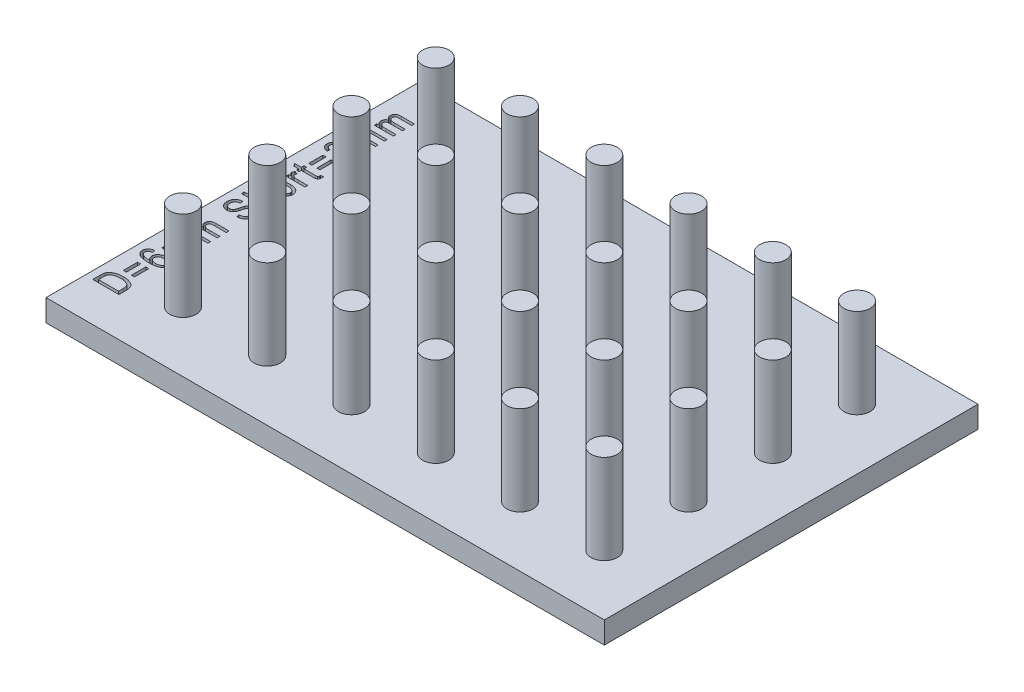
from build123d import *

# Parameters (mm, degrees)
SKETCH2_W            = 3
SKETCH2_H            = 20.5
SKETCH1_W            = 127.89
SKETCH1_H            = 85.6
BOSS_EXTRUDE2_DEPTH  = 5
LPATTERN2_COUNT      = 4
LPATTERN2_PITCH      = 19.3
LPATTERN2_COUNT_DIR2 = 6
LPATTERN2_PITCH_DIR2 = 19.3
SKETCH5_W            = 0.701298701
SKETCH5_H            = 3.272727273
CUT_EXTRUDE1_DEPTH   = 2


with BuildPart() as part:
    # Sketch2 → Revolve1 (revolve)
    with BuildSketch(Plane.XY.offset(-28.96), mode=Mode.PRIVATE) as revolve1_sk:
        with Locations((51.575, 10.25)):
            Rectangle(SKETCH2_W, SKETCH2_H)
    revolve1 = revolve(revolve1_sk.sketch.rotate(Axis((50.075, 20.5, -28.96), (0, -1, 0)), 90), axis=Axis((50.075, 20.5, -28.96), (0, -1, 0)))

    # Sketch1 → Boss-Extrude2 (add)
    with BuildSketch(Plane(origin=(0, 0, 0), x_dir=(1, 0, 0), z_dir=(0, 1, 0))):
        Rectangle(SKETCH1_W, SKETCH1_H)
    extrude(amount=-BOSS_EXTRUDE2_DEPTH)

    # LPattern2: Revolve1 4 × 6
    with Locations(*[(-j * LPATTERN2_PITCH_DIR2, 0, i * LPATTERN2_PITCH) for i in range(LPATTERN2_COUNT) for j in range(LPATTERN2_COUNT_DIR2) if (i, j) != (0, 0)]):
        add(revolve1)

    # Sketch5 → Cut-Extrude1 (cut)
    # profile 1 of 16: a face of its own
    with BuildSketch(Plane(origin=(0, 0, 0), x_dir=(1, 0, 0), z_dir=(0, 1, 0))):
        with BuildLine():
            Line((-56.194773063, 29.01038961), (-60.558409427, 29.01038961))
            Line((-60.558409427, 29.01038961), (-60.558409427, 29.555844156))
            Line((-60.558409427, 29.555844156), (-59.943555531, 29.555844156))
            add(Edge.make_bspline(
                [(-59.943555531, 29.555844156), (-59.996794447, 29.586562509), (-60.100876583, 29.64661692), (-60.239062939, 29.757621571), (-60.358476936, 29.88033732), (-60.45906551, 30.014597067), (-60.53843865, 30.159288059), (-60.594562214, 30.311996433), (-60.630633743, 30.470966982), (-60.634416703, 30.579594479), (-60.636331505, 30.634577922)],
                knots=[0, 0, 0, 0, 1.09277774, 2.136381581, 3.142818198, 4.133971442, 5.113525656, 6.068968217, 7.022579197, 8, 8, 8, 8], degree=3))
            add(Edge.make_bspline(
                [(-60.636331505, 30.634577922), (-60.634088382, 30.695234414), (-60.629756514, 30.812372853), (-60.593642069, 30.980999837), (-60.534033829, 31.134670316), (-60.449967949, 31.27311445), (-60.342936808, 31.395347706), (-60.212078766, 31.49780802), (-60.059955808, 31.582256408), (-59.947934839, 31.620483885), (-59.889984102, 31.64025974)],
                knots=[0, 0, 0, 0, 1.074449591, 2.074952659, 3.040944724, 3.983666911, 4.93191895, 5.905012228, 6.916220021, 8, 8, 8, 8], degree=3))
            add(Edge.make_bspline(
                [(-59.889984102, 31.64025974), (-59.949272949, 31.675937803), (-60.06335683, 31.7445897), (-60.215228096, 31.864404021), (-60.346217396, 31.989218716), (-60.452312831, 32.124636185), (-60.534399583, 32.267909744), (-60.59439712, 32.418483094), (-60.628882056, 32.577425368), (-60.633827602, 32.685959058), (-60.636331505, 32.740909091)],
                knots=[0, 0, 0, 0, 1.186540174, 2.283146265, 3.31266017, 4.285248268, 5.224385896, 6.137592124, 7.057072756, 8, 8, 8, 8], degree=3))
            add(Edge.make_bspline(
                [(-60.636331505, 32.740909091), (-60.635662931, 32.782375246), (-60.634352463, 32.863652906), (-60.616274438, 32.981776199), (-60.589881379, 33.093685186), (-60.55255542, 33.19860118), (-60.502559134, 33.296169023), (-60.443253099, 33.387747768), (-60.371944731, 33.47222846), (-60.289567405, 33.54961686), (-60.195568446, 33.619279307), (-60.088171681, 33.67981366), (-59.966788373, 33.728199749), (-59.834255708, 33.771908301), (-59.687932617, 33.802330565), (-59.529427595, 33.825716195), (-59.357322273, 33.83863731), (-59.238218024, 33.840561512), (-59.176510076, 33.841558442)],
                knots=[0, 0, 0, 0, 0.955498422, 1.872868982, 2.749207851, 3.604907424, 4.433768684, 5.272350985, 6.116089355, 6.976944253, 7.873691683, 8.808330241, 9.81133937, 10.882935648, 12.023104474, 13.252889189, 14.57672104, 16, 16, 16, 16], degree=3))
            Line((-59.176510076, 33.841558442), (-56.194773063, 33.841558442))
            Line((-56.194773063, 33.841558442), (-56.194773063, 33.218181818))
            Line((-56.194773063, 33.218181818), (-58.94152631, 33.218181818))
            add(Edge.make_bspline(
                [(-58.94152631, 33.218181818), (-59.013800725, 33.217899093), (-59.147135421, 33.21737751), (-59.33039957, 33.203505511), (-59.48020746, 33.185057393), (-59.599836599, 33.155859953), (-59.696209611, 33.116031616), (-59.778769772, 33.067861901), (-59.84883146, 33.006557818), (-59.908821132, 32.937846869), (-59.954925876, 32.860798314), (-59.988305286, 32.778698016), (-60.010143037, 32.692125174), (-60.01201268, 32.632272819), (-60.012954882, 32.60211039)],
                knots=[0, 0, 0, 0, 1.855735109, 3.42353348, 4.717873352, 5.729162317, 6.575113247, 7.388519106, 8.172054344, 8.955589582, 9.722515337, 10.465842131, 11.226865361, 12, 12, 12, 12], degree=3))
            add(Edge.make_bspline(
                [(-60.012954882, 32.60211039), (-60.0120605, 32.571201819), (-60.010296716, 32.510247892), (-59.995046391, 32.420843367), (-59.971459142, 32.335487786), (-59.935719712, 32.255427703), (-59.894436067, 32.1779667), (-59.83911388, 32.107553498), (-59.776745232, 32.039545337), (-59.704055196, 31.976451027), (-59.619767904, 31.91985003), (-59.525147467, 31.870312873), (-59.419123746, 31.828364282), (-59.30199092, 31.796867273), (-59.174505776, 31.769486113), (-59.035773633, 31.750329771), (-58.885691884, 31.739653929), (-58.782047121, 31.738341119), (-58.728458128, 31.737662338)],
                knots=[0, 0, 0, 0, 0.850256985, 1.676768018, 2.490111268, 3.280810737, 4.085979475, 4.899322724, 5.737306858, 6.624348552, 7.541552425, 8.52603189, 9.55919711, 10.673333412, 11.860946988, 13.147052635, 14.524898187, 16, 16, 16, 16], degree=3))
            Line((-58.728458128, 31.737662338), (-56.194773063, 31.737662338))
            Line((-56.194773063, 31.737662338), (-56.194773063, 31.114285714))
            Line((-56.194773063, 31.114285714), (-59.027971115, 31.114285714))
            add(Edge.make_bspline(
                [(-59.027971115, 31.114285714), (-59.071401885, 31.113808644), (-59.155082966, 31.112889439), (-59.275875268, 31.10617822), (-59.386249391, 31.092224273), (-59.487391484, 31.076021445), (-59.578154996, 31.052979895), (-59.659087752, 31.025438436), (-59.729626819, 30.992105197), (-59.809358656, 30.943132908), (-59.89132759, 30.869001665), (-59.961504189, 30.76139761), (-60.006879034, 30.638856427), (-60.010883285, 30.550981508), (-60.012954882, 30.505519481)],
                knots=[0, 0, 0, 0, 1.193618296, 2.299827258, 3.322171548, 4.249981195, 5.112908464, 5.892447954, 6.595906041, 7.252061334, 8.45997621, 9.595265847, 10.755912475, 12, 12, 12, 12], degree=3))
            add(Edge.make_bspline(
                [(-60.012954882, 30.505519481), (-60.012170325, 30.472576751), (-60.010639858, 30.408314033), (-59.994247841, 30.314638214), (-59.967610277, 30.226697703), (-59.930061932, 30.144115662), (-59.884467922, 30.065155247), (-59.824648938, 29.993598491), (-59.756461905, 29.926312381), (-59.677050321, 29.86400922), (-59.583162357, 29.808738881), (-59.47252185, 29.761748258), (-59.34520472, 29.721985932), (-59.200631396, 29.689424404), (-59.03910095, 29.6645255), (-58.860290467, 29.646513392), (-58.664469746, 29.635657548), (-58.527985697, 29.634413656), (-58.456948388, 29.633766234)],
                knots=[0, 0, 0, 0, 0.785764272, 1.532822213, 2.262268433, 2.973535088, 3.69469776, 4.431634212, 5.192142517, 5.97904095, 6.834803932, 7.785164623, 8.842330306, 10.015178037, 11.319777691, 12.741815971, 14.304178211, 16, 16, 16, 16], degree=3))
            Line((-58.456948388, 29.633766234), (-56.194773063, 29.633766234))
            Line((-56.194773063, 29.633766234), (-56.194773063, 29.01038961))
        make_face()
    # profile 2 of 16: a face of its own
    with BuildSketch(Plane(origin=(0, 0, 0), x_dir=(1, 0, 0), z_dir=(0, 1, 0))):
        with BuildLine():
            Line((-56.194773063, 22.784415584), (-60.558409427, 22.784415584))
            Line((-60.558409427, 22.784415584), (-60.558409427, 23.32987013))
            Line((-60.558409427, 23.32987013), (-59.943555531, 23.32987013))
            add(Edge.make_bspline(
                [(-59.943555531, 23.32987013), (-59.996794447, 23.360588483), (-60.100876583, 23.420642894), (-60.239062939, 23.531647545), (-60.358476936, 23.654363294), (-60.45906551, 23.788623041), (-60.53843865, 23.933314033), (-60.594562214, 24.086022407), (-60.630633743, 24.244992956), (-60.634416703, 24.353620453), (-60.636331505, 24.408603896)],
                knots=[0, 0, 0, 0, 1.09277774, 2.136381581, 3.142818198, 4.133971442, 5.113525656, 6.068968217, 7.022579197, 8, 8, 8, 8], degree=3))
            add(Edge.make_bspline(
                [(-60.636331505, 24.408603896), (-60.634088382, 24.469260388), (-60.629756514, 24.586398827), (-60.593642069, 24.755025812), (-60.534033829, 24.90869629), (-60.449967949, 25.047140424), (-60.342936808, 25.16937368), (-60.212078766, 25.271833994), (-60.059955808, 25.356282382), (-59.947934839, 25.394509859), (-59.889984102, 25.414285714)],
                knots=[0, 0, 0, 0, 1.074449591, 2.074952659, 3.040944724, 3.983666911, 4.93191895, 5.905012228, 6.916220021, 8, 8, 8, 8], degree=3))
            add(Edge.make_bspline(
                [(-59.889984102, 25.414285714), (-59.949272949, 25.449963777), (-60.06335683, 25.518615674), (-60.215228096, 25.638429995), (-60.346217396, 25.763244691), (-60.452312831, 25.898662159), (-60.534399583, 26.041935718), (-60.59439712, 26.192509068), (-60.628882056, 26.351451342), (-60.633827602, 26.459985032), (-60.636331505, 26.514935065)],
                knots=[0, 0, 0, 0, 1.186540174, 2.283146265, 3.31266017, 4.285248268, 5.224385896, 6.137592124, 7.057072756, 8, 8, 8, 8], degree=3))
            add(Edge.make_bspline(
                [(-60.636331505, 26.514935065), (-60.635662931, 26.55640122), (-60.634352463, 26.63767888), (-60.616274438, 26.755802173), (-60.589881379, 26.86771116), (-60.55255542, 26.972627154), (-60.502559134, 27.070194997), (-60.443253099, 27.161773742), (-60.371944731, 27.246254434), (-60.289567405, 27.323642834), (-60.195568446, 27.393305281), (-60.088171681, 27.453839634), (-59.966788373, 27.502225723), (-59.834255708, 27.545934275), (-59.687932617, 27.576356539), (-59.529427595, 27.599742169), (-59.357322273, 27.612663284), (-59.238218024, 27.614587486), (-59.176510076, 27.615584416)],
                knots=[0, 0, 0, 0, 0.955498422, 1.872868982, 2.749207851, 3.604907424, 4.433768684, 5.272350985, 6.116089355, 6.976944253, 7.873691683, 8.808330241, 9.81133937, 10.882935648, 12.023104474, 13.252889189, 14.57672104, 16, 16, 16, 16], degree=3))
            Line((-59.176510076, 27.615584416), (-56.194773063, 27.615584416))
            Line((-56.194773063, 27.615584416), (-56.194773063, 26.992207792))
            Line((-56.194773063, 26.992207792), (-58.94152631, 26.992207792))
            add(Edge.make_bspline(
                [(-58.94152631, 26.992207792), (-59.013800725, 26.991925067), (-59.147135421, 26.991403484), (-59.33039957, 26.977531485), (-59.48020746, 26.959083367), (-59.599836599, 26.929885927), (-59.696209611, 26.890057591), (-59.778769772, 26.841887875), (-59.84883146, 26.780583792), (-59.908821132, 26.711872843), (-59.954925876, 26.634824288), (-59.988305286, 26.55272399), (-60.010143037, 26.466151148), (-60.01201268, 26.406298793), (-60.012954882, 26.376136364)],
                knots=[0, 0, 0, 0, 1.855735109, 3.42353348, 4.717873352, 5.729162317, 6.575113247, 7.388519106, 8.172054344, 8.955589582, 9.722515337, 10.465842131, 11.226865361, 12, 12, 12, 12], degree=3))
            add(Edge.make_bspline(
                [(-60.012954882, 26.376136364), (-60.0120605, 26.345227793), (-60.010296716, 26.284273866), (-59.995046391, 26.194869341), (-59.971459142, 26.10951376), (-59.935719712, 26.029453677), (-59.894436067, 25.951992675), (-59.83911388, 25.881579472), (-59.776745232, 25.813571311), (-59.704055196, 25.750477001), (-59.619767904, 25.693876004), (-59.525147467, 25.644338847), (-59.419123746, 25.602390256), (-59.30199092, 25.570893247), (-59.174505776, 25.543512087), (-59.035773633, 25.524355745), (-58.885691884, 25.513679903), (-58.782047121, 25.512367093), (-58.728458128, 25.511688312)],
                knots=[0, 0, 0, 0, 0.850256985, 1.676768018, 2.490111268, 3.280810737, 4.085979475, 4.899322724, 5.737306858, 6.624348552, 7.541552425, 8.52603189, 9.55919711, 10.673333412, 11.860946988, 13.147052635, 14.524898187, 16, 16, 16, 16], degree=3))
            Line((-58.728458128, 25.511688312), (-56.194773063, 25.511688312))
            Line((-56.194773063, 25.511688312), (-56.194773063, 24.888311688))
            Line((-56.194773063, 24.888311688), (-59.027971115, 24.888311688))
            add(Edge.make_bspline(
                [(-59.027971115, 24.888311688), (-59.071401885, 24.887834618), (-59.155082966, 24.886915413), (-59.275875268, 24.880204194), (-59.386249391, 24.866250247), (-59.487391484, 24.850047419), (-59.578154996, 24.827005869), (-59.659087752, 24.79946441), (-59.729626819, 24.766131171), (-59.809358656, 24.717158882), (-59.89132759, 24.64302764), (-59.961504189, 24.535423584), (-60.006879034, 24.412882401), (-60.010883285, 24.325007482), (-60.012954882, 24.279545455)],
                knots=[0, 0, 0, 0, 1.193618296, 2.299827258, 3.322171548, 4.249981195, 5.112908464, 5.892447954, 6.595906041, 7.252061334, 8.45997621, 9.595265847, 10.755912475, 12, 12, 12, 12], degree=3))
            add(Edge.make_bspline(
                [(-60.012954882, 24.279545455), (-60.012170325, 24.246602725), (-60.010639858, 24.182340007), (-59.994247841, 24.088664188), (-59.967610277, 24.000723677), (-59.930061932, 23.918141636), (-59.884467922, 23.839181221), (-59.824648938, 23.767624465), (-59.756461905, 23.700338355), (-59.677050321, 23.638035194), (-59.583162357, 23.582764855), (-59.47252185, 23.535774232), (-59.34520472, 23.496011906), (-59.200631396, 23.463450378), (-59.03910095, 23.438551474), (-58.860290467, 23.420539366), (-58.664469746, 23.409683522), (-58.527985697, 23.40843963), (-58.456948388, 23.407792208)],
                knots=[0, 0, 0, 0, 0.785764272, 1.532822213, 2.262268433, 2.973535088, 3.69469776, 4.431634212, 5.192142517, 5.97904095, 6.834803932, 7.785164623, 8.842330306, 10.015178037, 11.319777691, 12.741815971, 14.304178211, 16, 16, 16, 16], degree=3))
            Line((-58.456948388, 23.407792208), (-56.194773063, 23.407792208))
            Line((-56.194773063, 23.407792208), (-56.194773063, 22.784415584))
        make_face()
    # profile 3 of 16: a face of its own
    with BuildSketch(Plane(origin=(0, 0, 0), x_dir=(1, 0, 0), z_dir=(0, 1, 0))):
        with BuildLine():
            Line((-57.8311367, 18.350649351), (-57.909058778, 18.974025974))
            add(Edge.make_bspline(
                [(-57.909058778, 18.974025974), (-57.861885468, 18.982065827), (-57.769961954, 18.997732557), (-57.637680101, 19.028557736), (-57.513898669, 19.062200514), (-57.399782933, 19.101193239), (-57.294218243, 19.143696446), (-57.197877702, 19.190829638), (-57.110777438, 19.24352629), (-57.032866966, 19.300489294), (-56.963777339, 19.361894597), (-56.903961119, 19.427462868), (-56.853461094, 19.497808178), (-56.811434304, 19.572259956), (-56.780257062, 19.651996385), (-56.756462625, 19.735450782), (-56.743228553, 19.823849359), (-56.741242457, 19.884293184), (-56.740227609, 19.915178571)],
                knots=[0, 0, 0, 0, 1.392235382, 2.712957193, 3.95076201, 5.123471921, 6.220028287, 7.260520794, 8.240826993, 9.178593426, 10.065213643, 10.926376853, 11.755607984, 12.580369742, 13.407158359, 14.241002189, 15.101193065, 16, 16, 16, 16], degree=3))
            add(Edge.make_bspline(
                [(-56.740227609, 19.915178571), (-56.740870359, 19.948959276), (-56.742133696, 20.015355823), (-56.760954199, 20.112655436), (-56.786648448, 20.207187376), (-56.826668203, 20.297321631), (-56.87584235, 20.384645265), (-56.935169907, 20.469268018), (-57.008513655, 20.547862939), (-57.089135725, 20.624404001), (-57.178645152, 20.694981076), (-57.27638363, 20.755901499), (-57.380697472, 20.806792517), (-57.49055326, 20.850638741), (-57.608307975, 20.880665822), (-57.731154749, 20.906324578), (-57.86131233, 20.918982677), (-57.950028969, 20.921029008), (-57.995503583, 20.922077922)],
                knots=[0, 0, 0, 0, 0.90401877, 1.776864238, 2.648081008, 3.525187418, 4.41175602, 5.332444618, 6.287459433, 7.287987893, 8.31086095, 9.337199425, 10.368656826, 11.419214808, 12.501240718, 13.621372252, 14.780756564, 16, 16, 16, 16], degree=3))
            add(Edge.make_bspline(
                [(-57.995503583, 20.922077922), (-58.038142587, 20.92097383), (-58.121159365, 20.918824199), (-58.24259014, 20.907000906), (-58.357633934, 20.885337817), (-58.46597638, 20.8529699), (-58.569286786, 20.814640416), (-58.665454319, 20.765715265), (-58.755035121, 20.707982977), (-58.837372403, 20.642659663), (-58.911636595, 20.57056997), (-58.977526901, 20.49443356), (-59.032918445, 20.413665823), (-59.076970292, 20.328284031), (-59.112444832, 20.239491611), (-59.138326354, 20.146511354), (-59.15309685, 20.049178813), (-59.154895234, 19.983004293), (-59.155812024, 19.949269481)],
                knots=[0, 0, 0, 0, 1.208597586, 2.353100882, 3.45394355, 4.52041929, 5.55433039, 6.572835576, 7.571467818, 8.570232532, 9.546354476, 10.500752408, 11.419554319, 12.314725937, 13.218209175, 14.125127028, 15.044216874, 16, 16, 16, 16], degree=3))
            add(Edge.make_bspline(
                [(-59.155812024, 19.949269481), (-59.154852128, 19.918768857), (-59.152805892, 19.853749918), (-59.135109871, 19.751368345), (-59.110238311, 19.638063886), (-59.085832129, 19.560302352), (-59.073019817, 19.519480519)],
                knots=[0, 0, 0, 0, 0.832645691, 1.774971563, 2.831945141, 4, 4, 4, 4], degree=3))
            Line((-59.073019817, 19.519480519), (-59.779188648, 19.597402597))
            Line((-59.779188648, 19.597402597), (-59.770665921, 19.691152597))
            add(Edge.make_bspline(
                [(-59.770665921, 19.691152597), (-59.771079756, 19.72732875), (-59.771887288, 19.797920654), (-59.78663296, 19.901190376), (-59.806414287, 19.999596061), (-59.835573571, 20.092781314), (-59.874449589, 20.179779879), (-59.918430326, 20.263425695), (-59.974498678, 20.339749546), (-60.035802398, 20.412074003), (-60.105721906, 20.475874342), (-60.179590735, 20.534238378), (-60.260795019, 20.581280832), (-60.346989879, 20.621196253), (-60.439145697, 20.650727653), (-60.53635455, 20.673477338), (-60.639304646, 20.684984381), (-60.709766409, 20.687183606), (-60.745909427, 20.688311688)],
                knots=[0, 0, 0, 0, 1.104751502, 2.155743671, 3.182513959, 4.171256571, 5.132373004, 6.092768569, 7.053244257, 8.020744794, 8.986334532, 9.941668794, 10.892724274, 11.847575109, 12.840124028, 13.845307576, 14.89476101, 16, 16, 16, 16], degree=3))
            add(Edge.make_bspline(
                [(-60.745909427, 20.688311688), (-60.81066735, 20.685537488), (-60.935120493, 20.68020597), (-61.11258747, 20.638641226), (-61.270213119, 20.567489174), (-61.404426268, 20.468137195), (-61.512857354, 20.349634162), (-61.592164418, 20.215952114), (-61.640483571, 20.068980024), (-61.646337305, 19.966269737), (-61.649318518, 19.913961039)],
                knots=[0, 0, 0, 0, 1.16832052, 2.245303051, 3.268291818, 4.269210926, 5.239185917, 6.148985104, 7.05730787, 8, 8, 8, 8], degree=3))
            add(Edge.make_bspline(
                [(-61.649318518, 19.913961039), (-61.64678647, 19.859629144), (-61.64186076, 19.753934776), (-61.595055306, 19.602724262), (-61.523053771, 19.464134088), (-61.437870791, 19.362165111), (-61.356084368, 19.290126371), (-61.286207647, 19.240219815), (-61.209491724, 19.194728104), (-61.12439434, 19.156640781), (-61.033317472, 19.119881009), (-60.933056309, 19.093907778), (-60.82669449, 19.06795594), (-60.752527328, 19.057396975), (-60.714253583, 19.051948052)],
                knots=[0, 0, 0, 0, 1.388978158, 2.702043981, 4.01873002, 5.370445164, 6.077879322, 6.808188353, 7.568116439, 8.359222831, 9.195597867, 10.081410868, 11.009917745, 12, 12, 12, 12], degree=3))
            Line((-60.714253583, 19.051948052), (-60.792175661, 18.428571429))
            add(Edge.make_bspline(
                [(-60.792175661, 18.428571429), (-60.851580586, 18.438778811), (-60.967461855, 18.458690364), (-61.134208616, 18.500290256), (-61.289984529, 18.549799641), (-61.433931812, 18.609743634), (-61.567300123, 18.677807333), (-61.689526629, 18.754815084), (-61.801413785, 18.83976386), (-61.899871255, 18.935604894), (-61.987562366, 19.037467774), (-62.063294028, 19.14541166), (-62.128478764, 19.257511992), (-62.180992712, 19.375616443), (-62.222633823, 19.498616034), (-62.251773954, 19.627126623), (-62.269000609, 19.760487896), (-62.27145185, 19.851004683), (-62.272695141, 19.896915584)],
                knots=[0, 0, 0, 0, 1.259750421, 2.457396855, 3.589696629, 4.673763457, 5.713494597, 6.716289503, 7.690389722, 8.644478697, 9.583164327, 10.496506905, 11.397350125, 12.289843847, 13.194037124, 14.107891875, 15.040306322, 16, 16, 16, 16], degree=3))
            add(Edge.make_bspline(
                [(-62.272695141, 19.896915584), (-62.271270916, 19.94529221), (-62.26846897, 20.040465841), (-62.246889579, 20.180325902), (-62.213460214, 20.314931131), (-62.164043146, 20.443285658), (-62.101583154, 20.566366686), (-62.024073127, 20.683364103), (-61.933810779, 20.795657713), (-61.830836053, 20.901063294), (-61.716902812, 20.996693617), (-61.594569376, 21.080975603), (-61.465509083, 21.153700193), (-61.327773005, 21.210557563), (-61.183539512, 21.255810239), (-61.032416608, 21.288573709), (-60.873890295, 21.308690405), (-60.765856789, 21.310673844), (-60.710600985, 21.311688312)],
                knots=[0, 0, 0, 0, 0.987388499, 1.942536239, 2.883158237, 3.814277833, 4.744511983, 5.696058098, 6.674468722, 7.682403848, 8.699933891, 9.706744222, 10.712052869, 11.718590333, 12.743383256, 13.79503062, 14.872226231, 16, 16, 16, 16], degree=3))
            add(Edge.make_bspline(
                [(-60.710600985, 21.311688312), (-60.643882468, 21.309812798), (-60.513582183, 21.306149947), (-60.324570632, 21.270843898), (-60.147245493, 21.214813301), (-59.982786245, 21.136664443), (-59.832037809, 21.039281863), (-59.698692079, 20.922313219), (-59.580495418, 20.788820972), (-59.518401457, 20.687319344), (-59.486980856, 20.635957792)],
                knots=[0, 0, 0, 0, 1.090109576, 2.128968013, 3.132278696, 4.123864162, 5.09769889, 6.057339906, 7.016980922, 8, 8, 8, 8], degree=3))
            add(Edge.make_bspline(
                [(-59.486980856, 20.635957792), (-59.472464391, 20.683136731), (-59.444101062, 20.775318389), (-59.380228275, 20.902489942), (-59.30605213, 21.018448713), (-59.217080967, 21.122059986), (-59.113284666, 21.214212008), (-58.993942509, 21.296497789), (-58.857913894, 21.367196198), (-58.708589214, 21.43106862), (-58.546074811, 21.481123499), (-58.373619867, 21.519580296), (-58.191276376, 21.541387713), (-58.066582661, 21.544078406), (-58.002808778, 21.545454545)],
                knots=[0, 0, 0, 0, 0.945190562, 1.846782401, 2.71900073, 3.580139159, 4.456653473, 5.37426406, 6.352713278, 7.392141409, 8.485180558, 9.608884637, 10.777077804, 12, 12, 12, 12], degree=3))
            add(Edge.make_bspline(
                [(-58.002808778, 21.545454545), (-57.934959506, 21.544246265), (-57.802496725, 21.541887327), (-57.608680223, 21.517758086), (-57.424194067, 21.480187297), (-57.24838442, 21.428652499), (-57.082918377, 21.359276566), (-56.926096995, 21.276813358), (-56.779622065, 21.177422887), (-56.643811716, 21.064460155), (-56.521089188, 20.94150326), (-56.41201825, 20.812027114), (-56.322678212, 20.674467545), (-56.245328246, 20.533435743), (-56.188554974, 20.384430303), (-56.146593259, 20.230390564), (-56.121929357, 20.069784807), (-56.118559087, 19.960715979), (-56.116850985, 19.905438312)],
                knots=[0, 0, 0, 0, 1.16811134, 2.280514916, 3.358044357, 4.408548324, 5.43018962, 6.443354211, 7.455384821, 8.473000684, 9.481330986, 10.444351977, 11.382702375, 12.302115503, 13.209492159, 14.121756026, 15.048078649, 16, 16, 16, 16], degree=3))
            add(Edge.make_bspline(
                [(-56.116850985, 19.905438312), (-56.118215139, 19.854224559), (-56.120902229, 19.75334442), (-56.143361674, 19.605154174), (-56.180257713, 19.463406533), (-56.229769781, 19.326846251), (-56.29674818, 19.197184955), (-56.376884212, 19.073043379), (-56.472051178, 18.95485362), (-56.580703997, 18.843694285), (-56.702405271, 18.742162873), (-56.833560635, 18.649861717), (-56.974714819, 18.569257383), (-57.127281782, 18.502361925), (-57.289099304, 18.446804041), (-57.460657686, 18.401309523), (-57.642256133, 18.36828186), (-57.767301875, 18.356608503), (-57.8311367, 18.350649351)],
                knots=[0, 0, 0, 0, 0.959215385, 1.889449177, 2.800558469, 3.700364268, 4.604976927, 5.528817283, 6.464628809, 7.443299003, 8.436397546, 9.430019983, 10.444889234, 11.476401659, 12.54654308, 13.647683262, 14.799161616, 16, 16, 16, 16], degree=3))
        make_face()
    # profile 4 of 16: a face of its own
    with BuildSketch(Plane(origin=(0, 0, 0), x_dir=(1, 0, 0), z_dir=(0, 1, 0))):
        with Locations((-60.129837999, 15.553246754)):
            Rectangle(SKETCH5_W, SKETCH5_H)
    # profile 5 of 16: a face of its own
    with BuildSketch(Plane(origin=(0, 0, 0), x_dir=(1, 0, 0), z_dir=(0, 1, 0))):
        with Locations((-58.259708129, 15.553246754)):
            Rectangle(SKETCH5_W, SKETCH5_H)
    # profile 6 of 16: a face of its own
    with BuildSketch(Plane(origin=(0, 0, 0), x_dir=(1, 0, 0), z_dir=(0, 1, 0))):
        with BuildLine():
            Line((-56.740227609, 12.911688312), (-56.116850985, 12.98961039))
            add(Edge.make_bspline(
                [(-56.116850985, 12.98961039), (-56.116850985, 12.908441558), (-56.116850985, 12.754626623), (-56.116850985, 12.600811688), (-56.116850985, 12.528165584)],
                knots=[0, 0, 0, 0, 1.055408971, 2, 2, 2, 2], degree=3))
            add(Edge.make_bspline(
                [(-56.116850985, 12.528165584), (-56.117993308, 12.476927065), (-56.1201733, 12.37914424), (-56.14365325, 12.239933226), (-56.181544429, 12.115845976), (-56.237076653, 12.008197071), (-56.306322039, 11.91727513), (-56.386003526, 11.839858574), (-56.479179938, 11.780244336), (-56.565931866, 11.741129356), (-56.646677186, 11.719048241), (-56.721305053, 11.705283975), (-56.808858055, 11.691200071), (-56.910220606, 11.682849922), (-57.024171649, 11.673354454), (-57.151745123, 11.66970592), (-57.292552719, 11.665398396), (-57.391196657, 11.665094085), (-57.442743843, 11.664935065)],
                knots=[0, 0, 0, 0, 1.327537123, 2.533451998, 3.648458666, 4.679281776, 5.655925806, 6.601279112, 7.544110141, 8.510092609, 9.056534812, 9.710807872, 10.477334036, 11.354881073, 12.346884118, 13.442198059, 14.66339995, 16, 16, 16, 16], degree=3))
            Line((-57.442743843, 11.664935065), (-59.935032804, 11.664935065))
            Line((-59.935032804, 11.664935065), (-59.935032804, 11.197402597))
            Line((-59.935032804, 11.197402597), (-60.558409427, 11.197402597))
            Line((-60.558409427, 11.197402597), (-60.558409427, 11.664935065))
            Line((-60.558409427, 11.664935065), (-61.649318518, 11.664935065))
            Line((-61.649318518, 11.664935065), (-62.116850985, 12.288311688))
            Line((-62.116850985, 12.288311688), (-60.558409427, 12.288311688))
            Line((-60.558409427, 12.288311688), (-60.558409427, 12.911688312))
            Line((-60.558409427, 12.911688312), (-59.935032804, 12.911688312))
            Line((-59.935032804, 12.911688312), (-59.935032804, 12.288311688))
            Line((-59.935032804, 12.288311688), (-57.351428908, 12.288311688))
            add(Edge.make_bspline(
                [(-57.351428908, 12.288311688), (-57.2970019, 12.288934563), (-57.198599187, 12.290060705), (-57.067393529, 12.299378342), (-56.966102472, 12.312957737), (-56.912488624, 12.334188848), (-56.889984102, 12.343100649)],
                knots=[0, 0, 0, 0, 1.396202311, 2.524300029, 3.380571947, 4, 4, 4, 4], degree=3))
            add(Edge.make_bspline(
                [(-56.889984102, 12.343100649), (-56.866774323, 12.357921705), (-56.820759165, 12.387305579), (-56.773434711, 12.458155234), (-56.74493446, 12.543872744), (-56.741866894, 12.606637526), (-56.740227609, 12.640178571)],
                knots=[0, 0, 0, 0, 0.935281465, 1.854266853, 2.853335735, 4, 4, 4, 4], degree=3))
            add(Edge.make_bspline(
                [(-56.740227609, 12.640178571), (-56.740227609, 12.680357143), (-56.740227609, 12.77086039), (-56.740227609, 12.861363636), (-56.740227609, 12.911688312)],
                knots=[0, 0, 0, 0, 0.887892377, 2, 2, 2, 2], degree=3))
        make_face()
    # profile 7 of 16: a face of its own
    with BuildSketch(Plane(origin=(0, 0, 0), x_dir=(1, 0, 0), z_dir=(0, 1, 0))):
        with BuildLine():
            Line((-56.194773063, 8.78961039), (-60.558409427, 8.78961039))
            Line((-60.558409427, 8.78961039), (-60.558409427, 9.412987013))
            Line((-60.558409427, 9.412987013), (-59.861980856, 9.412987013))
            add(Edge.make_bspline(
                [(-59.861980856, 9.412987013), (-59.899467388, 9.428893558), (-59.971719428, 9.459552046), (-60.073334331, 9.508932753), (-60.16669489, 9.55447011), (-60.249322484, 9.600875666), (-60.322427526, 9.645929671), (-60.38652911, 9.688886472), (-60.43854154, 9.73361419), (-60.496832247, 9.787002994), (-60.552802853, 9.85907809), (-60.600985553, 9.951074955), (-60.63071904, 10.048768185), (-60.634445117, 10.115705849), (-60.636331505, 10.149594156)],
                knots=[0, 0, 0, 0, 1.289148127, 2.484721217, 3.576629365, 4.577643693, 5.48348476, 6.296217029, 7.01687274, 7.653195915, 8.797172521, 9.883470605, 10.928471757, 12, 12, 12, 12], degree=3))
            add(Edge.make_bspline(
                [(-60.636331505, 10.149594156), (-60.6334316, 10.198221572), (-60.62749407, 10.297785799), (-60.579724619, 10.446133039), (-60.506757566, 10.596107674), (-60.43827365, 10.689149272), (-60.402565271, 10.737662338)],
                knots=[0, 0, 0, 0, 0.90443484, 1.851822771, 2.879913239, 4, 4, 4, 4], degree=3))
            Line((-60.402565271, 10.737662338), (-59.779188648, 10.503896104))
            add(Edge.make_bspline(
                [(-59.779188648, 10.503896104), (-59.791164407, 10.467951842), (-59.814598477, 10.397616398), (-59.838802343, 10.290847221), (-59.854240012, 10.185764083), (-59.856160296, 10.115960891), (-59.857110726, 10.081412338)],
                knots=[0, 0, 0, 0, 1.052765664, 2.060043406, 3.039833393, 4, 4, 4, 4], degree=3))
            add(Edge.make_bspline(
                [(-59.857110726, 10.081412338), (-59.855569161, 10.050765986), (-59.852512339, 9.989996259), (-59.824660767, 9.901648687), (-59.783398603, 9.816772555), (-59.724433714, 9.737531153), (-59.649785889, 9.666856385), (-59.561021236, 9.607288442), (-59.459954148, 9.557560305), (-59.386320631, 9.535308032), (-59.348182154, 9.523782468)],
                knots=[0, 0, 0, 0, 0.902618499, 1.789833916, 2.711577979, 3.679817708, 4.688442158, 5.732050055, 6.825315446, 8, 8, 8, 8], degree=3))
            add(Edge.make_bspline(
                [(-59.348182154, 9.523782468), (-59.277381335, 9.506454828), (-59.13473392, 9.471543607), (-58.9143236, 9.438804045), (-58.68789977, 9.417271901), (-58.534516559, 9.414426151), (-58.456948388, 9.412987013)],
                knots=[0, 0, 0, 0, 0.970935534, 1.956212433, 2.966426232, 4, 4, 4, 4], degree=3))
            Line((-58.456948388, 9.412987013), (-56.194773063, 9.412987013))
            Line((-56.194773063, 9.412987013), (-56.194773063, 8.78961039))
        make_face()
    # profile 8 of 16: a face of its own
    with BuildSketch(Plane(origin=(0, 0, 0), x_dir=(1, 0, 0), z_dir=(0, 1, 0))):
        with BuildLine():
            add(Edge.make_bspline(
                [(-58.376591245, 4.277922078), (-58.467132289, 4.27928892), (-58.642813501, 4.28194107), (-58.897611108, 4.303338571), (-59.134936249, 4.34178717), (-59.355845565, 4.391253562), (-59.559343452, 4.459046709), (-59.746239974, 4.539818563), (-59.915757597, 4.636545412), (-60.067339127, 4.747729767), (-60.200660524, 4.870729229), (-60.317907643, 5.001391089), (-60.41546071, 5.141271616), (-60.496811575, 5.287821836), (-60.559189545, 5.442943676), (-60.60445647, 5.605766311), (-60.631867174, 5.77699189), (-60.634828139, 5.893892842), (-60.636331505, 5.953246753)],
                knots=[0, 0, 0, 0, 1.372615356, 2.66335266, 3.872178191, 5.015461052, 6.09146209, 7.11917872, 8.097582965, 9.043965428, 9.962824734, 10.843241285, 11.700166529, 12.54283542, 13.379213377, 14.2286393, 15.100630205, 16, 16, 16, 16], degree=3))
            add(Edge.make_bspline(
                [(-60.636331505, 5.953246753), (-60.634860957, 6.011794868), (-60.631975095, 6.126692098), (-60.604186991, 6.295433608), (-60.558929104, 6.456556827), (-60.49716105, 6.611152211), (-60.415065016, 6.756885523), (-60.317981225, 6.896623098), (-60.200376503, 7.027379586), (-60.067149055, 7.150950855), (-59.91758588, 7.265381623), (-59.749445977, 7.36185878), (-59.56684623, 7.445855567), (-59.367656522, 7.51165833), (-59.153520051, 7.564205841), (-58.923492973, 7.60130035), (-58.677819902, 7.624993071), (-58.508547804, 7.627357487), (-58.421639946, 7.628571429)],
                knots=[0, 0, 0, 0, 0.900791373, 1.767750072, 2.624289306, 3.473596755, 4.32382302, 5.193995394, 6.088022225, 7.025323188, 7.988790235, 8.980037915, 10.003375839, 11.078233703, 12.204178496, 13.394686787, 14.662377368, 16, 16, 16, 16], degree=3))
            add(Edge.make_bspline(
                [(-58.421639946, 7.628571429), (-58.327446356, 7.627224699), (-58.14528072, 7.624620191), (-57.881185886, 7.603090404), (-57.636115801, 7.564910845), (-57.408714148, 7.515413796), (-57.200929708, 7.447597285), (-57.010421208, 7.368072211), (-56.83889977, 7.2714652), (-56.686422912, 7.16026181), (-56.552151764, 7.038195573), (-56.435312758, 6.907490166), (-56.337747752, 6.767654968), (-56.256049665, 6.620829841), (-56.194262134, 6.465063878), (-56.148679909, 6.301963187), (-56.121262487, 6.130312405), (-56.11833986, 6.013006127), (-56.116850985, 5.953246753)],
                knots=[0, 0, 0, 0, 1.408046467, 2.723090573, 3.957003681, 5.113903491, 6.197953371, 7.220063424, 8.195363977, 9.133438347, 10.035383127, 10.903513923, 11.748481219, 12.579391103, 13.409724873, 14.247297497, 15.107120221, 16, 16, 16, 16], degree=3))
            add(Edge.make_bspline(
                [(-56.116850985, 5.953246753), (-56.118377552, 5.894707133), (-56.121394262, 5.779024609), (-56.148669781, 5.609379896), (-56.194299801, 5.447514272), (-56.256147673, 5.292359115), (-56.338805478, 5.14663698), (-56.437153115, 5.006857662), (-56.554498787, 4.875937349), (-56.688642479, 4.752683196), (-56.83996012, 4.639828338), (-57.009785735, 4.542692095), (-57.196768791, 4.461393663), (-57.39972516, 4.392615657), (-57.620384269, 4.340963119), (-57.857836789, 4.305601216), (-58.111481211, 4.281325694), (-58.286432924, 4.279079576), (-58.376591245, 4.277922078)],
                knots=[0, 0, 0, 0, 0.888220062, 1.755247792, 2.599833291, 3.437287932, 4.284027875, 5.137020532, 6.027268132, 6.9473103, 7.898569105, 8.886643144, 9.910042229, 10.989381947, 12.135544892, 13.344969722, 14.631776334, 16, 16, 16, 16], degree=3))
        make_face()
        with BuildLine():
            add(Edge.make_bspline(
                [(-58.37902631, 4.901298701), (-58.312026278, 4.902120034), (-58.182321746, 4.903710042), (-57.994640771, 4.919106497), (-57.819821622, 4.940744799), (-57.659003708, 4.975650719), (-57.510439022, 5.016919362), (-57.376161195, 5.07156374), (-57.253524649, 5.132394387), (-57.145813049, 5.205382757), (-57.050821139, 5.284572422), (-56.967668718, 5.368313855), (-56.897412942, 5.456911674), (-56.839398721, 5.549695913), (-56.795368469, 5.648199552), (-56.763723174, 5.751213568), (-56.743326592, 5.858693773), (-56.741267046, 5.932051581), (-56.740227609, 5.969074675)],
                knots=[0, 0, 0, 0, 1.469396759, 2.844586976, 4.128878436, 5.330198352, 6.451600231, 7.506349503, 8.505728137, 9.448964922, 10.352897054, 11.215368435, 12.032926495, 12.828471979, 13.609488255, 14.3923291, 15.188621458, 16, 16, 16, 16], degree=3))
            add(Edge.make_bspline(
                [(-56.740227609, 5.969074675), (-56.741265123, 6.004074831), (-56.743320674, 6.073418118), (-56.763746736, 6.174843489), (-56.795638508, 6.272720414), (-56.840879693, 6.366355088), (-56.899261165, 6.456434352), (-56.96983723, 6.542646176), (-57.053747002, 6.624796672), (-57.149870123, 6.702311582), (-57.258187566, 6.774962764), (-57.380735546, 6.836479044), (-57.515620644, 6.889192929), (-57.663823036, 6.930976241), (-57.824317995, 6.965588635), (-57.998281163, 6.987425233), (-58.184352713, 7.002742147), (-58.312838932, 7.004360922), (-58.37902631, 7.005194805)],
                knots=[0, 0, 0, 0, 0.7775166, 1.540437603, 2.291087349, 3.062133518, 3.845755338, 4.673215918, 5.534822761, 6.452469894, 7.416230061, 8.429396884, 9.495379179, 10.632252772, 11.850147013, 13.143211061, 14.528376255, 16, 16, 16, 16], degree=3))
            add(Edge.make_bspline(
                [(-58.37902631, 7.005194805), (-58.445620214, 7.004371522), (-58.574513624, 7.002778045), (-58.760985802, 6.987416428), (-58.934963088, 6.965618411), (-59.095409898, 6.930874945), (-59.243919025, 6.889494521), (-59.378045833, 6.835330188), (-59.50004814, 6.773377327), (-59.60839909, 6.701482359), (-59.703573029, 6.622290226), (-59.785491768, 6.537767349), (-59.855820209, 6.449630149), (-59.913770627, 6.356785059), (-59.957817521, 6.258297292), (-59.989458365, 6.155279031), (-60.009856143, 6.047799967), (-60.011915527, 5.974442004), (-60.012954882, 5.937418831)],
                knots=[0, 0, 0, 0, 1.463546366, 2.832713969, 4.110844125, 5.314672625, 6.438416205, 7.495367994, 8.488894281, 9.44152376, 10.347343474, 11.205377213, 12.02464249, 12.821849225, 13.604496411, 14.388971977, 15.186927145, 16, 16, 16, 16], degree=3))
            add(Edge.make_bspline(
                [(-60.012954882, 5.937418831), (-60.011956743, 5.902004446), (-60.009990425, 5.832238575), (-59.989174028, 5.730125334), (-59.957978163, 5.631553279), (-59.911652275, 5.537964085), (-59.856142256, 5.44626338), (-59.784011215, 5.361404446), (-59.700775021, 5.279680806), (-59.606037734, 5.2011584), (-59.497191121, 5.130960778), (-59.375945676, 5.068331192), (-59.241145308, 5.01625424), (-59.093557881, 4.974080608), (-58.93317927, 4.941204384), (-58.759794636, 4.918962027), (-58.573693513, 4.903780671), (-58.445211515, 4.90214255), (-58.37902631, 4.901298701)],
                knots=[0, 0, 0, 0, 0.787375897, 1.551120116, 2.31116761, 3.083045763, 3.870317969, 4.691693902, 5.554230447, 6.465864855, 7.425702106, 8.431921499, 9.499054023, 10.63715434, 11.845669186, 13.140128493, 14.526788325, 16, 16, 16, 16], degree=3))
        make_face(mode=Mode.SUBTRACT)
    # profile 9 of 16: a face of its own
    with BuildSketch(Plane(origin=(0, 0, 0), x_dir=(1, 0, 0), z_dir=(0, 1, 0))):
        with BuildLine():
            Line((-56.194773063, 0.233766234), (-62.194773063, 0.233766234))
            Line((-62.194773063, 0.233766234), (-62.194773063, 0.857142857))
            Line((-62.194773063, 0.857142857), (-60.049480856, 0.857142857))
            add(Edge.make_bspline(
                [(-60.049480856, 0.857142857), (-60.096086527, 0.892355663), (-60.186690812, 0.960811518), (-60.307025482, 1.076149983), (-60.408560324, 1.198364919), (-60.493043572, 1.326822707), (-60.555984558, 1.463513488), (-60.603535412, 1.605724019), (-60.630282959, 1.755902921), (-60.634292632, 1.858260676), (-60.636331505, 1.910308442)],
                knots=[0, 0, 0, 0, 1.115529506, 2.168657786, 3.176523762, 4.146685432, 5.097307861, 6.043967695, 7.005379594, 8, 8, 8, 8], degree=3))
            add(Edge.make_bspline(
                [(-60.636331505, 1.910308442), (-60.635153076, 1.955820332), (-60.632861201, 2.044334384), (-60.615293159, 2.173546584), (-60.587482902, 2.29547396), (-60.549132096, 2.410732019), (-60.496725898, 2.517517482), (-60.435200017, 2.617770398), (-60.360601666, 2.709978017), (-60.275565804, 2.796262828), (-60.17355214, 2.873310149), (-60.052959429, 2.938426301), (-59.914052879, 2.994407963), (-59.756979346, 3.039943141), (-59.581058385, 3.075377548), (-59.386381105, 3.097997336), (-59.173149587, 3.114873813), (-59.024762739, 3.116195796), (-58.947613972, 3.116883117)],
                knots=[0, 0, 0, 0, 0.918936283, 1.787198329, 2.628261467, 3.44216605, 4.23402106, 5.02553662, 5.812796688, 6.624221109, 7.466840479, 8.383983785, 9.384005558, 10.486291561, 11.682268669, 13.003934646, 14.442296275, 16, 16, 16, 16], degree=3))
            Line((-58.947613972, 3.116883117), (-56.194773063, 3.116883117))
            Line((-56.194773063, 3.116883117), (-56.194773063, 2.493506494))
            Line((-56.194773063, 2.493506494), (-58.954919167, 2.493506494))
            add(Edge.make_bspline(
                [(-58.954919167, 2.493506494), (-59.000402128, 2.493335898), (-59.088237283, 2.493006449), (-59.214894868, 2.482149146), (-59.331923467, 2.469118135), (-59.43860693, 2.4461724), (-59.535818506, 2.42033495), (-59.623341734, 2.388054449), (-59.699291305, 2.346807869), (-59.766786157, 2.302287991), (-59.825216493, 2.251382511), (-59.874681283, 2.195162175), (-59.918021503, 2.135655143), (-59.952234921, 2.070609465), (-59.980967449, 2.002124492), (-59.998055891, 1.927537451), (-60.011472689, 1.849508537), (-60.012452728, 1.795519917), (-60.012954882, 1.767857143)],
                knots=[0, 0, 0, 0, 1.497580373, 2.892076563, 4.185500246, 5.373247229, 6.482481593, 7.498006995, 8.436991536, 9.323193913, 10.157024237, 10.980826884, 11.785865632, 12.575436512, 13.39717544, 14.224009969, 15.090015417, 16, 16, 16, 16], degree=3))
            add(Edge.make_bspline(
                [(-60.012954882, 1.767857143), (-60.012028426, 1.73695474), (-60.010189373, 1.675612234), (-59.995255618, 1.585729298), (-59.970926303, 1.498863176), (-59.934884451, 1.416516992), (-59.891325665, 1.336106415), (-59.835631355, 1.261142977), (-59.772017102, 1.188273936), (-59.697420698, 1.119884123), (-59.610150646, 1.056348767), (-59.506479319, 1.003888362), (-59.389107191, 0.956747955), (-59.255505774, 0.921821398), (-59.107622874, 0.892047681), (-58.944353299, 0.872660892), (-58.766052386, 0.858256238), (-58.642047299, 0.857524064), (-58.577484102, 0.857142857)],
                knots=[0, 0, 0, 0, 0.774321057, 1.537058296, 2.277762361, 3.029907886, 3.785897217, 4.565348269, 5.365507915, 6.208015593, 7.097442594, 8.062237367, 9.112711579, 10.26295355, 11.518033273, 12.89232435, 14.381989977, 16, 16, 16, 16], degree=3))
            Line((-58.577484102, 0.857142857), (-56.194773063, 0.857142857))
            Line((-56.194773063, 0.857142857), (-56.194773063, 0.233766234))
        make_face()
    # profile 10 of 16: a face of its own
    with BuildSketch(Plane(origin=(0, 0, 0), x_dir=(1, 0, 0), z_dir=(0, 1, 0))):
        with BuildLine():
            Line((-58.142825011, -4.901298701), (-58.220747089, -4.277922078))
            add(Edge.make_bspline(
                [(-58.220747089, -4.277922078), (-58.14138096, -4.268854721), (-57.990862488, -4.251658409), (-57.780154624, -4.204393333), (-57.597164323, -4.141834996), (-57.438708988, -4.062768237), (-57.302979713, -3.964164666), (-57.181712858, -3.849537909), (-57.075573715, -3.715703192), (-56.984697957, -3.564608992), (-56.910243956, -3.399312911), (-56.856862808, -3.222154501), (-56.824348866, -3.034794031), (-56.820246612, -2.906707181), (-56.818149687, -2.841233766)],
                knots=[0, 0, 0, 0, 1.280778799, 2.429006815, 3.456446437, 4.376522676, 5.25823019, 6.137819947, 7.045792748, 7.989273456, 8.95968453, 9.946210303, 10.950176202, 12, 12, 12, 12], degree=3))
            add(Edge.make_bspline(
                [(-56.818149687, -2.841233766), (-56.819103063, -2.794524785), (-56.820955871, -2.703749684), (-56.834774462, -2.571542843), (-56.855876368, -2.447120654), (-56.887735547, -2.331050289), (-56.928192477, -2.223127198), (-56.976379133, -2.122510274), (-57.035768377, -2.030881853), (-57.102065314, -1.946653532), (-57.177138796, -1.872824361), (-57.255681229, -1.806320983), (-57.340930836, -1.751167334), (-57.431274059, -1.70533248), (-57.527967489, -1.67240128), (-57.628608218, -1.645624128), (-57.735351874, -1.631329482), (-57.808371914, -1.629505189), (-57.845747089, -1.628571429)],
                knots=[0, 0, 0, 0, 1.250368061, 2.429988454, 3.555466068, 4.625717287, 5.646966169, 6.638353842, 7.605933407, 8.564748095, 9.502142402, 10.420384068, 11.315510552, 12.214519894, 13.125272963, 14.045056381, 14.999365656, 16, 16, 16, 16], degree=3))
            add(Edge.make_bspline(
                [(-57.845747089, -1.628571429), (-57.888858385, -1.629911434), (-57.972828716, -1.63252144), (-58.095065041, -1.654740086), (-58.20835076, -1.692616226), (-58.313513936, -1.74420536), (-58.40985412, -1.810738404), (-58.496533135, -1.893444199), (-58.574799191, -1.990324366), (-58.632651357, -2.084139104), (-58.675464468, -2.173867394), (-58.7101546, -2.259603631), (-58.749271502, -2.36170261), (-58.790563312, -2.481523559), (-58.833861617, -2.618491668), (-58.880161543, -2.772835517), (-58.93018597, -2.943966569), (-58.96321873, -3.064396461), (-58.980487349, -3.127353896)],
                knots=[0, 0, 0, 0, 1.005098215, 1.957687139, 2.885733572, 3.78329401, 4.681403461, 5.605578984, 6.568089027, 7.579631243, 8.168180425, 8.885482001, 9.736450909, 10.718456922, 11.841193521, 13.087089992, 14.477210763, 16, 16, 16, 16], degree=3))
            add(Edge.make_bspline(
                [(-58.980487349, -3.127353896), (-58.996433371, -3.183851774), (-59.027163812, -3.292731893), (-59.076269352, -3.44890084), (-59.124201412, -3.592640437), (-59.174489581, -3.723715377), (-59.225110393, -3.841784409), (-59.274989326, -3.947859933), (-59.325908016, -4.040799731), (-59.395048888, -4.146746935), (-59.488780117, -4.263597474), (-59.613739813, -4.387946704), (-59.753232431, -4.495529229), (-59.906171535, -4.585715171), (-60.070815324, -4.658785814), (-60.248266719, -4.707188522), (-60.43496943, -4.740942542), (-60.563527329, -4.743931633), (-60.62902631, -4.745454545)],
                knots=[0, 0, 0, 0, 1.11393077, 2.146716259, 3.106268884, 3.988737651, 4.809862157, 5.543595319, 6.212328163, 6.818977705, 7.942346038, 9.047832148, 10.156933811, 11.275646334, 12.410283173, 13.563353315, 14.758552549, 16, 16, 16, 16], degree=3))
            add(Edge.make_bspline(
                [(-60.62902631, -4.745454545), (-60.687947411, -4.744110912), (-60.803774423, -4.741469598), (-60.973300976, -4.718918122), (-61.135169174, -4.683179861), (-61.287628782, -4.629824882), (-61.432929114, -4.564638462), (-61.568145389, -4.48157616), (-61.697276718, -4.386749025), (-61.815812623, -4.276161704), (-61.922765688, -4.153103499), (-62.01756435, -4.019856427), (-62.096620374, -3.875415218), (-62.161641053, -3.720841926), (-62.211412081, -3.555906028), (-62.246025899, -3.380930514), (-62.268892743, -3.196136659), (-62.27140609, -3.069389517), (-62.272695141, -3.004383117)],
                knots=[0, 0, 0, 0, 1.048393069, 2.060929513, 3.038830284, 3.993780679, 4.931247035, 5.867877984, 6.812802159, 7.778917813, 8.746652657, 9.710740501, 10.683960439, 11.671447009, 12.69068745, 13.744764791, 14.843329183, 16, 16, 16, 16], degree=3))
            add(Edge.make_bspline(
                [(-62.272695141, -3.004383117), (-62.270404473, -2.915724146), (-62.265933086, -2.742661691), (-62.223004832, -2.492353038), (-62.157070724, -2.258146727), (-62.061300537, -2.042949048), (-61.941301211, -1.84724831), (-61.795388328, -1.674771438), (-61.627083582, -1.524288409), (-61.43450791, -1.399104257), (-61.222082623, -1.297783953), (-60.990742637, -1.223591757), (-60.741731505, -1.175222906), (-60.569184447, -1.165854666), (-60.480487349, -1.161038961)],
                knots=[0, 0, 0, 0, 1.103033465, 2.153123098, 3.152679255, 4.125499792, 5.076296761, 6.001544301, 6.928570303, 7.877444987, 8.851642669, 9.850432098, 10.895023555, 12, 12, 12, 12], degree=3))
            Line((-60.480487349, -1.161038961), (-60.402565271, -1.784415584))
            add(Edge.make_bspline(
                [(-60.402565271, -1.784415584), (-60.450545989, -1.788988389), (-60.544112092, -1.797905711), (-60.678709874, -1.822547249), (-60.804211454, -1.854032516), (-60.919900858, -1.893540476), (-61.025452603, -1.943068889), (-61.121990844, -1.998767964), (-61.209452167, -2.062294282), (-61.286455784, -2.134536965), (-61.353746356, -2.21454719), (-61.413102322, -2.301359501), (-61.461365418, -2.397128111), (-61.501609401, -2.499867552), (-61.533550471, -2.609812638), (-61.55491581, -2.727737778), (-61.568531546, -2.853090931), (-61.570425187, -2.93941119), (-61.57139644, -2.983685065)],
                knots=[0, 0, 0, 0, 1.224893265, 2.388636439, 3.474727904, 4.51239488, 5.491031007, 6.434269947, 7.342314655, 8.23289818, 9.11144624, 9.995731571, 10.900193307, 11.831391373, 12.797987004, 13.805778543, 14.874578387, 16, 16, 16, 16], degree=3))
            add(Edge.make_bspline(
                [(-61.57139644, -2.983685065), (-61.571010182, -3.028781582), (-61.570263597, -3.115947016), (-61.555536529, -3.242722977), (-61.536086873, -3.361436228), (-61.506468814, -3.47224789), (-61.469090092, -3.574203043), (-61.423450956, -3.668720117), (-61.369132058, -3.754515467), (-61.30650078, -3.832053689), (-61.236857714, -3.899958496), (-61.162791651, -3.959695896), (-61.084016258, -4.010782381), (-60.99934299, -4.050599221), (-60.910030903, -4.08239779), (-60.815900017, -4.10576776), (-60.716663211, -4.119077677), (-60.64895163, -4.12106454), (-60.614415921, -4.122077922)],
                knots=[0, 0, 0, 0, 1.28677749, 2.487165856, 3.639785246, 4.719183444, 5.756778416, 6.736320351, 7.710431992, 8.649732596, 9.575714218, 10.482424581, 11.363216052, 12.249555033, 13.147559346, 14.066626488, 15.013899474, 16, 16, 16, 16], degree=3))
            add(Edge.make_bspline(
                [(-60.614415921, -4.122077922), (-60.552527909, -4.1199502), (-60.434454195, -4.115890802), (-60.268394544, -4.079864919), (-60.123395918, -4.017884704), (-60.044323735, -3.95621683), (-60.005649687, -3.926055195)],
                knots=[0, 0, 0, 0, 1.13496852, 2.165362018, 3.1026822, 4, 4, 4, 4], degree=3))
            add(Edge.make_bspline(
                [(-60.005649687, -3.926055195), (-59.987155551, -3.907508802), (-59.94698725, -3.867227003), (-59.896379428, -3.789645636), (-59.843138329, -3.697297164), (-59.794850492, -3.58538323), (-59.744219339, -3.457982543), (-59.697800245, -3.311878442), (-59.649771836, -3.148923969), (-59.621250508, -3.033326079), (-59.606299037, -2.972727273)],
                knots=[0, 0, 0, 0, 0.600125557, 1.303441474, 2.117395318, 3.047759802, 4.098473224, 5.265768101, 6.566659033, 8, 8, 8, 8], degree=3))
            add(Edge.make_bspline(
                [(-59.606299037, -2.972727273), (-59.591911529, -2.913011544), (-59.564265953, -2.798267859), (-59.520863973, -2.63379873), (-59.48171136, -2.482304875), (-59.440950324, -2.345508535), (-59.403787173, -2.221794986), (-59.366627326, -2.11255715), (-59.334008441, -2.015853936), (-59.30876421, -1.95757341), (-59.297045791, -1.930519481)],
                knots=[0, 0, 0, 0, 1.354622716, 2.602905581, 3.751413711, 4.805080968, 5.750717443, 6.599847983, 7.350046792, 8, 8, 8, 8], degree=3))
            add(Edge.make_bspline(
                [(-59.297045791, -1.930519481), (-59.261861183, -1.85744011), (-59.193542473, -1.715540324), (-59.057714509, -1.528198123), (-58.906760003, -1.365357295), (-58.732473658, -1.234408157), (-58.540632524, -1.13055044), (-58.330069, -1.057893744), (-58.102523146, -1.012906259), (-57.944989089, -1.007812967), (-57.864010076, -1.005194805)],
                knots=[0, 0, 0, 0, 1.070359847, 2.078340734, 3.046206706, 3.99595094, 4.946634449, 5.919011396, 6.930285904, 8, 8, 8, 8], degree=3))
            add(Edge.make_bspline(
                [(-57.864010076, -1.005194805), (-57.782629327, -1.007842975), (-57.621828454, -1.013075516), (-57.386619987, -1.059513729), (-57.1624827, -1.135397524), (-56.953011366, -1.241507995), (-56.76028102, -1.371472109), (-56.589056922, -1.523850234), (-56.445423306, -1.701183683), (-56.325287889, -1.898305694), (-56.230769063, -2.117453244), (-56.16469755, -2.357945906), (-56.123773404, -2.619464387), (-56.119211956, -2.800897048), (-56.116850985, -2.894805195)],
                knots=[0, 0, 0, 0, 1.01143777, 1.998507955, 2.969111388, 3.946647698, 4.909937751, 5.853623903, 6.786336586, 7.737808315, 8.716842446, 9.744489446, 10.832565119, 12, 12, 12, 12], degree=3))
            add(Edge.make_bspline(
                [(-56.116850985, -2.894805195), (-56.118400787, -2.96874647), (-56.121425024, -3.113033205), (-56.147486375, -3.323304088), (-56.189841858, -3.521893498), (-56.249695397, -3.709133395), (-56.326353227, -3.885888609), (-56.421957327, -4.050305667), (-56.533131608, -4.203872383), (-56.661515953, -4.343767707), (-56.80380945, -4.470338134), (-56.958969988, -4.58192184), (-57.127145995, -4.675848473), (-57.307038574, -4.754053481), (-57.4988043, -4.81581748), (-57.70237297, -4.862474555), (-57.918415721, -4.8915784), (-58.066845172, -4.89800763), (-58.142825011, -4.901298701)],
                knots=[0, 0, 0, 0, 1.105181298, 2.156616858, 3.162303259, 4.137147331, 5.090895204, 6.036968316, 6.975166548, 7.920090863, 8.869970344, 9.81800681, 10.771619553, 11.744478679, 12.746148078, 13.779480727, 14.863334085, 16, 16, 16, 16], degree=3))
        make_face()
    # profile 11 of 16: a face of its own
    with BuildSketch(Plane(origin=(0, 0, 0), x_dir=(1, 0, 0), z_dir=(0, 1, 0))):
        with BuildLine():
            Line((-56.194773063, -13.457142857), (-60.558409427, -13.457142857))
            Line((-60.558409427, -13.457142857), (-60.558409427, -12.911688312))
            Line((-60.558409427, -12.911688312), (-59.943555531, -12.911688312))
            add(Edge.make_bspline(
                [(-59.943555531, -12.911688312), (-59.996794447, -12.880969959), (-60.100876583, -12.820915547), (-60.239062939, -12.709910897), (-60.358476936, -12.587195148), (-60.45906551, -12.452935401), (-60.53843865, -12.308244408), (-60.594562214, -12.155536034), (-60.630633743, -11.996565485), (-60.634416703, -11.887937988), (-60.636331505, -11.832954545)],
                knots=[0, 0, 0, 0, 1.09277774, 2.136381581, 3.142818198, 4.133971442, 5.113525656, 6.068968217, 7.022579197, 8, 8, 8, 8], degree=3))
            add(Edge.make_bspline(
                [(-60.636331505, -11.832954545), (-60.634088382, -11.772298054), (-60.629756514, -11.655159615), (-60.593642069, -11.48653263), (-60.534033829, -11.332862151), (-60.449967949, -11.194418018), (-60.342936808, -11.072184762), (-60.212078766, -10.969724448), (-60.059955808, -10.88527606), (-59.947934839, -10.847048582), (-59.889984102, -10.827272727)],
                knots=[0, 0, 0, 0, 1.074449591, 2.074952659, 3.040944724, 3.983666911, 4.93191895, 5.905012228, 6.916220021, 8, 8, 8, 8], degree=3))
            add(Edge.make_bspline(
                [(-59.889984102, -10.827272727), (-59.949272949, -10.791594665), (-60.06335683, -10.722942767), (-60.215228096, -10.603128447), (-60.346217396, -10.478313751), (-60.452312831, -10.342896282), (-60.534399583, -10.199622724), (-60.59439712, -10.049049374), (-60.628882056, -9.8901071), (-60.633827602, -9.781573409), (-60.636331505, -9.726623377)],
                knots=[0, 0, 0, 0, 1.186540174, 2.283146265, 3.31266017, 4.285248268, 5.224385896, 6.137592124, 7.057072756, 8, 8, 8, 8], degree=3))
            add(Edge.make_bspline(
                [(-60.636331505, -9.726623377), (-60.635662931, -9.685157221), (-60.634352463, -9.603879561), (-60.616274438, -9.485756268), (-60.589881379, -9.373847282), (-60.55255542, -9.268931288), (-60.502559134, -9.171363444), (-60.443253099, -9.0797847), (-60.371944731, -8.995304008), (-60.289567405, -8.917915608), (-60.195568446, -8.84825316), (-60.088171681, -8.787718808), (-59.966788373, -8.739332719), (-59.834255708, -8.695624166), (-59.687932617, -8.665201903), (-59.529427595, -8.641816273), (-59.357322273, -8.628895158), (-59.238218024, -8.626970956), (-59.176510076, -8.625974026)],
                knots=[0, 0, 0, 0, 0.955498422, 1.872868982, 2.749207851, 3.604907424, 4.433768684, 5.272350985, 6.116089355, 6.976944253, 7.873691683, 8.808330241, 9.81133937, 10.882935648, 12.023104474, 13.252889189, 14.57672104, 16, 16, 16, 16], degree=3))
            Line((-59.176510076, -8.625974026), (-56.194773063, -8.625974026))
            Line((-56.194773063, -8.625974026), (-56.194773063, -9.249350649))
            Line((-56.194773063, -9.249350649), (-58.94152631, -9.249350649))
            add(Edge.make_bspline(
                [(-58.94152631, -9.249350649), (-59.013800725, -9.249633375), (-59.147135421, -9.250154958), (-59.33039957, -9.264026957), (-59.48020746, -9.282475074), (-59.599836599, -9.311672514), (-59.696209611, -9.351500851), (-59.778769772, -9.399670567), (-59.84883146, -9.460974649), (-59.908821132, -9.529685599), (-59.954925876, -9.606734153), (-59.988305286, -9.688834452), (-60.010143037, -9.775407294), (-60.01201268, -9.835259648), (-60.012954882, -9.865422078)],
                knots=[0, 0, 0, 0, 1.855735109, 3.42353348, 4.717873352, 5.729162317, 6.575113247, 7.388519106, 8.172054344, 8.955589582, 9.722515337, 10.465842131, 11.226865361, 12, 12, 12, 12], degree=3))
            add(Edge.make_bspline(
                [(-60.012954882, -9.865422078), (-60.0120605, -9.896330648), (-60.010296716, -9.957284575), (-59.995046391, -10.046689101), (-59.971459142, -10.132044682), (-59.935719712, -10.212104764), (-59.894436067, -10.289565767), (-59.83911388, -10.359978969), (-59.776745232, -10.427987131), (-59.704055196, -10.491081441), (-59.619767904, -10.547682438), (-59.525147467, -10.597219594), (-59.419123746, -10.639168185), (-59.30199092, -10.670665195), (-59.174505776, -10.698046355), (-59.035773633, -10.717202697), (-58.885691884, -10.727878538), (-58.782047121, -10.729191348), (-58.728458128, -10.72987013)],
                knots=[0, 0, 0, 0, 0.850256985, 1.676768018, 2.490111268, 3.280810737, 4.085979475, 4.899322724, 5.737306858, 6.624348552, 7.541552425, 8.52603189, 9.55919711, 10.673333412, 11.860946988, 13.147052635, 14.524898187, 16, 16, 16, 16], degree=3))
            Line((-58.728458128, -10.72987013), (-56.194773063, -10.72987013))
            Line((-56.194773063, -10.72987013), (-56.194773063, -11.353246753))
            Line((-56.194773063, -11.353246753), (-59.027971115, -11.353246753))
            add(Edge.make_bspline(
                [(-59.027971115, -11.353246753), (-59.071401885, -11.353723824), (-59.155082966, -11.354643029), (-59.275875268, -11.361354248), (-59.386249391, -11.375308195), (-59.487391484, -11.391511023), (-59.578154996, -11.414552572), (-59.659087752, -11.442094031), (-59.729626819, -11.475427271), (-59.809358656, -11.524399559), (-59.89132759, -11.598530802), (-59.961504189, -11.706134858), (-60.006879034, -11.82867604), (-60.010883285, -11.916550959), (-60.012954882, -11.962012987)],
                knots=[0, 0, 0, 0, 1.193618296, 2.299827258, 3.322171548, 4.249981195, 5.112908464, 5.892447954, 6.595906041, 7.252061334, 8.45997621, 9.595265847, 10.755912475, 12, 12, 12, 12], degree=3))
            add(Edge.make_bspline(
                [(-60.012954882, -11.962012987), (-60.012170325, -11.994955717), (-60.010639858, -12.059218435), (-59.994247841, -12.152894254), (-59.967610277, -12.240834764), (-59.930061932, -12.323416806), (-59.884467922, -12.402377221), (-59.824648938, -12.473933977), (-59.756461905, -12.541220086), (-59.677050321, -12.603523248), (-59.583162357, -12.658793586), (-59.47252185, -12.705784209), (-59.34520472, -12.745546535), (-59.200631396, -12.778108063), (-59.03910095, -12.803006967), (-58.860290467, -12.821019076), (-58.664469746, -12.831874919), (-58.527985697, -12.833118812), (-58.456948388, -12.833766234)],
                knots=[0, 0, 0, 0, 0.785764272, 1.532822213, 2.262268433, 2.973535088, 3.69469776, 4.431634212, 5.192142517, 5.97904095, 6.834803932, 7.785164623, 8.842330306, 10.015178037, 11.319777691, 12.741815971, 14.304178211, 16, 16, 16, 16], degree=3))
            Line((-58.456948388, -12.833766234), (-56.194773063, -12.833766234))
            Line((-56.194773063, -12.833766234), (-56.194773063, -13.457142857))
        make_face()
    # profile 12 of 16: a face of its own
    with BuildSketch(Plane(origin=(0, 0, 0), x_dir=(1, 0, 0), z_dir=(0, 1, 0))):
        with BuildLine():
            Line((-56.194773063, -19.683116883), (-60.558409427, -19.683116883))
            Line((-60.558409427, -19.683116883), (-60.558409427, -19.137662338))
            Line((-60.558409427, -19.137662338), (-59.943555531, -19.137662338))
            add(Edge.make_bspline(
                [(-59.943555531, -19.137662338), (-59.996794447, -19.106943985), (-60.100876583, -19.046889573), (-60.239062939, -18.935884923), (-60.358476936, -18.813169174), (-60.45906551, -18.678909427), (-60.53843865, -18.534218434), (-60.594562214, -18.38151006), (-60.630633743, -18.222539511), (-60.634416703, -18.113912014), (-60.636331505, -18.058928571)],
                knots=[0, 0, 0, 0, 1.09277774, 2.136381581, 3.142818198, 4.133971442, 5.113525656, 6.068968217, 7.022579197, 8, 8, 8, 8], degree=3))
            add(Edge.make_bspline(
                [(-60.636331505, -18.058928571), (-60.634088382, -17.99827208), (-60.629756514, -17.881133641), (-60.593642069, -17.712506656), (-60.534033829, -17.558836177), (-60.449967949, -17.420392044), (-60.342936808, -17.298158788), (-60.212078766, -17.195698474), (-60.059955808, -17.111250086), (-59.947934839, -17.073022608), (-59.889984102, -17.053246753)],
                knots=[0, 0, 0, 0, 1.074449591, 2.074952659, 3.040944724, 3.983666911, 4.93191895, 5.905012228, 6.916220021, 8, 8, 8, 8], degree=3))
            add(Edge.make_bspline(
                [(-59.889984102, -17.053246753), (-59.949272949, -17.017568691), (-60.06335683, -16.948916793), (-60.215228096, -16.829102473), (-60.346217396, -16.704287777), (-60.452312831, -16.568870308), (-60.534399583, -16.42559675), (-60.59439712, -16.2750234), (-60.628882056, -16.116081126), (-60.633827602, -16.007547435), (-60.636331505, -15.952597403)],
                knots=[0, 0, 0, 0, 1.186540174, 2.283146265, 3.31266017, 4.285248268, 5.224385896, 6.137592124, 7.057072756, 8, 8, 8, 8], degree=3))
            add(Edge.make_bspline(
                [(-60.636331505, -15.952597403), (-60.635662931, -15.911131247), (-60.634352463, -15.829853587), (-60.616274438, -15.711730294), (-60.589881379, -15.599821307), (-60.55255542, -15.494905314), (-60.502559134, -15.39733747), (-60.443253099, -15.305758726), (-60.371944731, -15.221278034), (-60.289567405, -15.143889634), (-60.195568446, -15.074227186), (-60.088171681, -15.013692834), (-59.966788373, -14.965306745), (-59.834255708, -14.921598192), (-59.687932617, -14.891175929), (-59.529427595, -14.867790299), (-59.357322273, -14.854869184), (-59.238218024, -14.852944982), (-59.176510076, -14.851948052)],
                knots=[0, 0, 0, 0, 0.955498422, 1.872868982, 2.749207851, 3.604907424, 4.433768684, 5.272350985, 6.116089355, 6.976944253, 7.873691683, 8.808330241, 9.81133937, 10.882935648, 12.023104474, 13.252889189, 14.57672104, 16, 16, 16, 16], degree=3))
            Line((-59.176510076, -14.851948052), (-56.194773063, -14.851948052))
            Line((-56.194773063, -14.851948052), (-56.194773063, -15.475324675))
            Line((-56.194773063, -15.475324675), (-58.94152631, -15.475324675))
            add(Edge.make_bspline(
                [(-58.94152631, -15.475324675), (-59.013800725, -15.475607401), (-59.147135421, -15.476128984), (-59.33039957, -15.490000983), (-59.48020746, -15.5084491), (-59.599836599, -15.53764654), (-59.696209611, -15.577474877), (-59.778769772, -15.625644593), (-59.84883146, -15.686948675), (-59.908821132, -15.755659625), (-59.954925876, -15.832708179), (-59.988305286, -15.914808478), (-60.010143037, -16.00138132), (-60.01201268, -16.061233674), (-60.012954882, -16.091396104)],
                knots=[0, 0, 0, 0, 1.855735109, 3.42353348, 4.717873352, 5.729162317, 6.575113247, 7.388519106, 8.172054344, 8.955589582, 9.722515337, 10.465842131, 11.226865361, 12, 12, 12, 12], degree=3))
            add(Edge.make_bspline(
                [(-60.012954882, -16.091396104), (-60.0120605, -16.122304674), (-60.010296716, -16.183258601), (-59.995046391, -16.272663127), (-59.971459142, -16.358018708), (-59.935719712, -16.43807879), (-59.894436067, -16.515539793), (-59.83911388, -16.585952995), (-59.776745232, -16.653961157), (-59.704055196, -16.717055467), (-59.619767904, -16.773656464), (-59.525147467, -16.82319362), (-59.419123746, -16.865142211), (-59.30199092, -16.896639221), (-59.174505776, -16.924020381), (-59.035773633, -16.943176723), (-58.885691884, -16.953852564), (-58.782047121, -16.955165374), (-58.728458128, -16.955844156)],
                knots=[0, 0, 0, 0, 0.850256985, 1.676768018, 2.490111268, 3.280810737, 4.085979475, 4.899322724, 5.737306858, 6.624348552, 7.541552425, 8.52603189, 9.55919711, 10.673333412, 11.860946988, 13.147052635, 14.524898187, 16, 16, 16, 16], degree=3))
            Line((-58.728458128, -16.955844156), (-56.194773063, -16.955844156))
            Line((-56.194773063, -16.955844156), (-56.194773063, -17.579220779))
            Line((-56.194773063, -17.579220779), (-59.027971115, -17.579220779))
            add(Edge.make_bspline(
                [(-59.027971115, -17.579220779), (-59.071401885, -17.57969785), (-59.155082966, -17.580617055), (-59.275875268, -17.587328274), (-59.386249391, -17.601282221), (-59.487391484, -17.617485049), (-59.578154996, -17.640526598), (-59.659087752, -17.668068057), (-59.729626819, -17.701401297), (-59.809358656, -17.750373585), (-59.89132759, -17.824504828), (-59.961504189, -17.932108884), (-60.006879034, -18.054650066), (-60.010883285, -18.142524985), (-60.012954882, -18.187987013)],
                knots=[0, 0, 0, 0, 1.193618296, 2.299827258, 3.322171548, 4.249981195, 5.112908464, 5.892447954, 6.595906041, 7.252061334, 8.45997621, 9.595265847, 10.755912475, 12, 12, 12, 12], degree=3))
            add(Edge.make_bspline(
                [(-60.012954882, -18.187987013), (-60.012170325, -18.220929743), (-60.010639858, -18.285192461), (-59.994247841, -18.37886828), (-59.967610277, -18.46680879), (-59.930061932, -18.549390832), (-59.884467922, -18.628351247), (-59.824648938, -18.699908003), (-59.756461905, -18.767194112), (-59.677050321, -18.829497274), (-59.583162357, -18.884767612), (-59.47252185, -18.931758235), (-59.34520472, -18.971520561), (-59.200631396, -19.004082089), (-59.03910095, -19.028980993), (-58.860290467, -19.046993102), (-58.664469746, -19.057848945), (-58.527985697, -19.059092838), (-58.456948388, -19.05974026)],
                knots=[0, 0, 0, 0, 0.785764272, 1.532822213, 2.262268433, 2.973535088, 3.69469776, 4.431634212, 5.192142517, 5.97904095, 6.834803932, 7.785164623, 8.842330306, 10.015178037, 11.319777691, 12.741815971, 14.304178211, 16, 16, 16, 16], degree=3))
            Line((-58.456948388, -19.05974026), (-56.194773063, -19.05974026))
            Line((-56.194773063, -19.05974026), (-56.194773063, -19.683116883))
        make_face()
    # profile 13 of 16: a face of its own
    with BuildSketch(Plane(origin=(0, 0, 0), x_dir=(1, 0, 0), z_dir=(0, 1, 0))):
        with BuildLine():
            Line((-60.792175661, -21), (-60.714253583, -21.623376623))
            add(Edge.make_bspline(
                [(-60.714253583, -21.623376623), (-60.785249682, -21.637785933), (-60.918192866, -21.664767972), (-61.098288758, -21.723291703), (-61.248866279, -21.788497955), (-61.328764668, -21.848798114), (-61.365633453, -21.876623377)],
                knots=[0, 0, 0, 0, 1.230211225, 2.30362229, 3.217213433, 4, 4, 4, 4], degree=3))
            add(Edge.make_bspline(
                [(-61.365633453, -21.876623377), (-61.388410066, -21.896858441), (-61.432697383, -21.936203917), (-61.490065605, -22.001596265), (-61.539507632, -22.068923042), (-61.58021754, -22.139725991), (-61.61065458, -22.214839743), (-61.632440171, -22.292865999), (-61.646328837, -22.37370157), (-61.648316036, -22.428516395), (-61.649318518, -22.456168831)],
                knots=[0, 0, 0, 0, 1.09495211, 2.12904747, 3.12182315, 4.09596367, 5.058329339, 6.028853599, 7.005615717, 8, 8, 8, 8], degree=3))
            add(Edge.make_bspline(
                [(-61.649318518, -22.456168831), (-61.647729096, -22.499006985), (-61.644580132, -22.58387799), (-61.610631166, -22.707043633), (-61.559655114, -22.824297158), (-61.48592932, -22.93399854), (-61.392061183, -23.036357022), (-61.278936122, -23.133550947), (-61.143957369, -23.221924835), (-61.044706348, -23.273227391), (-60.993068518, -23.299918831)],
                knots=[0, 0, 0, 0, 0.906800098, 1.796553483, 2.691003266, 3.610512055, 4.585978966, 5.630213089, 6.767058994, 8, 8, 8, 8], degree=3))
            add(Edge.make_bspline(
                [(-60.993068518, -23.299918831), (-60.943503823, -23.322320541), (-60.840457741, -23.368894184), (-60.6725331, -23.423508813), (-60.488485934, -23.471502144), (-60.28670922, -23.507488316), (-60.069293587, -23.540205591), (-59.8343039, -23.561065714), (-59.582923136, -23.574699267), (-59.409484482, -23.576558759), (-59.320178908, -23.577516234)],
                knots=[0, 0, 0, 0, 0.763508889, 1.587351645, 2.476402758, 3.433472996, 4.464603951, 5.563935012, 6.745641893, 8, 8, 8, 8], degree=3))
            add(Edge.make_bspline(
                [(-59.320178908, -23.577516234), (-59.380941264, -23.542214392), (-59.499172948, -23.473523898), (-59.654204497, -23.345620232), (-59.789037353, -23.207955603), (-59.898912156, -23.056329853), (-59.984257306, -22.895344777), (-60.04552492, -22.728676927), (-60.083997745, -22.557347871), (-60.088577747, -22.441349419), (-60.090876959, -22.383116883)],
                knots=[0, 0, 0, 0, 1.127689085, 2.194262806, 3.218345157, 4.217743143, 5.19231177, 6.137448631, 7.064978137, 8, 8, 8, 8], degree=3))
            add(Edge.make_bspline(
                [(-60.090876959, -22.383116883), (-60.089193459, -22.334720319), (-60.085875387, -22.239333797), (-60.060764956, -22.098575989), (-60.019007195, -21.963074918), (-59.961578425, -21.831572895), (-59.886054743, -21.705377009), (-59.794818391, -21.58359146), (-59.685983146, -21.467744454), (-59.564294352, -21.355807551), (-59.427218313, -21.254192734), (-59.277886745, -21.165068348), (-59.117863913, -21.089016905), (-58.945733044, -21.028655745), (-58.763540348, -20.979711751), (-58.569626292, -20.945737424), (-58.364801039, -20.926701736), (-58.224438943, -20.923643777), (-58.152565271, -20.922077922)],
                knots=[0, 0, 0, 0, 0.860357646, 1.695709716, 2.533583491, 3.377064945, 4.241047709, 5.143225219, 6.077846286, 7.063889573, 8.080111547, 9.106229702, 10.152257742, 11.225204373, 12.345649275, 13.503769734, 14.721782881, 16, 16, 16, 16], degree=3))
            add(Edge.make_bspline(
                [(-58.152565271, -20.922077922), (-58.055027509, -20.924564048), (-57.863961523, -20.9294341), (-57.58420831, -20.970239297), (-57.318851015, -21.038968875), (-57.108492769, -21.116782357), (-56.950925409, -21.191717564), (-56.840922163, -21.251094494), (-56.739481985, -21.315390641), (-56.644006535, -21.38089585), (-56.559303272, -21.454000896), (-56.480087028, -21.527719382), (-56.410894601, -21.607558047), (-56.328923472, -21.716802586), (-56.242999134, -21.860341772), (-56.170882265, -22.044745092), (-56.125008307, -22.237210209), (-56.11958328, -22.369063399), (-56.116850985, -22.435470779)],
                knots=[0, 0, 0, 0, 1.657594599, 3.247049531, 4.793269837, 6.310589185, 7.051271314, 7.758283223, 8.434037218, 9.092523529, 9.724148541, 10.334150818, 10.930619913, 11.517069014, 12.655365671, 13.76103642, 14.872354135, 16, 16, 16, 16], degree=3))
            add(Edge.make_bspline(
                [(-56.116850985, -22.435470779), (-56.118951647, -22.495278574), (-56.123083345, -22.612911835), (-56.155983765, -22.785130765), (-56.208199344, -22.949335894), (-56.282253451, -23.105766145), (-56.377919567, -23.254010259), (-56.49601221, -23.392789067), (-56.634003416, -23.524026905), (-56.792598989, -23.647976803), (-56.977500024, -23.759416403), (-57.189310729, -23.856658043), (-57.429744989, -23.937896353), (-57.698222336, -24.001907531), (-57.994134795, -24.054411999), (-58.317769759, -24.091324071), (-58.669714855, -24.113052815), (-58.913490479, -24.115573481), (-59.04014644, -24.116883117)],
                knots=[0, 0, 0, 0, 0.76079261, 1.49636878, 2.22335124, 2.948937493, 3.692613516, 4.462506464, 5.262670056, 6.113081641, 7.019393936, 8.004001644, 9.074018115, 10.244225697, 11.513927426, 12.897326774, 14.387976403, 16, 16, 16, 16], degree=3))
            add(Edge.make_bspline(
                [(-59.04014644, -24.116883117), (-59.180607686, -24.115730543), (-59.451184509, -24.113510287), (-59.841530004, -24.089671919), (-60.200588522, -24.053612474), (-60.5282034, -23.99987411), (-60.824961161, -23.933301667), (-61.090388597, -23.849067129), (-61.325886175, -23.752372361), (-61.528964453, -23.636118973), (-61.704159582, -23.508979574), (-61.854912106, -23.37282569), (-61.984769101, -23.230019195), (-62.090579145, -23.077131589), (-62.171345219, -22.914382153), (-62.230849201, -22.744074269), (-62.265305613, -22.564283087), (-62.270206724, -22.441701854), (-62.272695141, -22.379464286)],
                knots=[0, 0, 0, 0, 1.648729313, 3.176021509, 4.589257728, 5.883210501, 7.07130447, 8.156186091, 9.149022935, 10.053769316, 10.896205842, 11.685573168, 12.434569159, 13.157455576, 13.86058765, 14.561213295, 15.269491877, 16, 16, 16, 16], degree=3))
            add(Edge.make_bspline(
                [(-62.272695141, -22.379464286), (-62.271411706, -22.334373019), (-62.268881805, -22.245489321), (-62.252276946, -22.114721294), (-62.221281443, -21.990132704), (-62.17948878, -21.871216832), (-62.127643445, -21.756944633), (-62.060973262, -21.649959779), (-61.983693036, -21.547898612), (-61.89480313, -21.452101995), (-61.795055792, -21.362317247), (-61.682178801, -21.283848212), (-61.559985363, -21.213054524), (-61.427572343, -21.150205573), (-61.283864892, -21.098468475), (-61.129457798, -21.056197997), (-60.964877576, -21.021444655), (-60.850751464, -21.007273445), (-60.792175661, -21)],
                knots=[0, 0, 0, 0, 0.965466884, 1.903123866, 2.815643703, 3.708762019, 4.59904389, 5.49616866, 6.401586744, 7.336219343, 8.290161022, 9.268947462, 10.273430203, 11.311221761, 12.402489703, 13.538768752, 14.73676065, 16, 16, 16, 16], degree=3))
        make_face()
        with BuildLine():
            add(Edge.make_bspline(
                [(-58.175698388, -23.493506494), (-58.122906317, -23.492612251), (-58.019951414, -23.490868304), (-57.869358791, -23.476095848), (-57.726752133, -23.451341449), (-57.591311667, -23.419921485), (-57.465276071, -23.374724294), (-57.345933196, -23.323061946), (-57.235509958, -23.25930658), (-57.133121421, -23.187719406), (-57.041665248, -23.10950507), (-56.961610808, -23.026984906), (-56.892892538, -22.942408893), (-56.83774938, -22.853291567), (-56.792801031, -22.76199682), (-56.762869269, -22.666245572), (-56.743647486, -22.568142077), (-56.741371086, -22.501712784), (-56.740227609, -22.468344156)],
                knots=[0, 0, 0, 0, 1.295915113, 2.527288866, 3.709970359, 4.848208075, 5.935365449, 6.992568332, 8.036874269, 9.05966364, 10.056099687, 10.986214356, 11.87941223, 12.725402229, 13.554321318, 14.370446187, 15.18144582, 16, 16, 16, 16], degree=3))
            add(Edge.make_bspline(
                [(-56.740227609, -22.468344156), (-56.741506697, -22.438648234), (-56.744050819, -22.379582652), (-56.761169699, -22.292481335), (-56.791533534, -22.208647186), (-56.831580779, -22.126458422), (-56.884752928, -22.046997767), (-56.949364201, -21.970314067), (-57.026273447, -21.897373726), (-57.111563066, -21.82505624), (-57.209013197, -21.760737978), (-57.313597962, -21.700494109), (-57.429482757, -21.654560345), (-57.552261833, -21.613290293), (-57.685067207, -21.58404406), (-57.825492226, -21.559934882), (-57.975443154, -21.548841334), (-58.077879232, -21.546606059), (-58.130649687, -21.545454545)],
                knots=[0, 0, 0, 0, 0.772713955, 1.536938285, 2.298458163, 3.087170851, 3.910203315, 4.779624773, 5.690759825, 6.665637977, 7.684919877, 8.72499675, 9.799719792, 10.921806825, 12.09248587, 13.333813582, 14.6265008, 16, 16, 16, 16], degree=3))
            add(Edge.make_bspline(
                [(-58.130649687, -21.545454545), (-58.18221084, -21.546558846), (-58.282231456, -21.548701017), (-58.428371525, -21.560417814), (-58.565079542, -21.582211882), (-58.693557904, -21.612463813), (-58.812186429, -21.652871463), (-58.923300943, -21.699952455), (-59.024556717, -21.75772903), (-59.116948412, -21.82281754), (-59.198130396, -21.89542213), (-59.271338001, -21.970117452), (-59.33017239, -22.051611797), (-59.382019469, -22.134359512), (-59.418862859, -22.223195655), (-59.448115541, -22.314976393), (-59.463317857, -22.411435427), (-59.466099897, -22.476824386), (-59.467500336, -22.50974026)],
                knots=[0, 0, 0, 0, 1.34413917, 2.607420863, 3.817865127, 4.949372023, 6.043265408, 7.080878207, 8.089894499, 9.076140083, 10.020536592, 10.925912695, 11.795477937, 12.63545564, 13.464706931, 14.294565263, 15.141508349, 16, 16, 16, 16], degree=3))
            add(Edge.make_bspline(
                [(-59.467500336, -22.50974026), (-59.466825548, -22.542301367), (-59.46549145, -22.606676604), (-59.446960945, -22.700802314), (-59.420847276, -22.792421759), (-59.380688321, -22.879949872), (-59.332315587, -22.965767781), (-59.272017906, -23.047697905), (-59.200485222, -23.125814273), (-59.119580574, -23.201038209), (-59.028957382, -23.270029809), (-58.929539199, -23.330394364), (-58.822052144, -23.379566356), (-58.707776354, -23.421530062), (-58.585621237, -23.454475761), (-58.455619505, -23.477117253), (-58.318028829, -23.490612785), (-58.224025102, -23.492523967), (-58.175698388, -23.493506494)],
                knots=[0, 0, 0, 0, 0.863336265, 1.706866888, 2.538958102, 3.388184842, 4.257154246, 5.151813003, 6.08274342, 7.06663784, 8.081968542, 9.102321145, 10.14869887, 11.215962244, 12.332381785, 13.503694224, 14.716665185, 16, 16, 16, 16], degree=3))
        make_face(mode=Mode.SUBTRACT)
    # profile 14 of 16: a face of its own
    with BuildSketch(Plane(origin=(0, 0, 0), x_dir=(1, 0, 0), z_dir=(0, 1, 0))):
        with Locations((-60.129837999, -26.914285715)):
            Rectangle(SKETCH5_W, SKETCH5_H)
    # profile 15 of 16: a face of its own
    with BuildSketch(Plane(origin=(0, 0, 0), x_dir=(1, 0, 0), z_dir=(0, 1, 0))):
        with Locations((-58.259708129, -26.914285715)):
            Rectangle(SKETCH5_W, SKETCH5_H)
    # profile 16 of 16: a face of its own
    with BuildSketch(Plane(origin=(0, 0, 0), x_dir=(1, 0, 0), z_dir=(0, 1, 0))):
        with BuildLine():
            Line((-56.194773063, -33.841558442), (-62.194773063, -33.841558442))
            Line((-62.194773063, -33.841558442), (-62.194773063, -32.150405844))
            add(Edge.make_bspline(
                [(-62.194773063, -32.150405844), (-62.194788552, -32.099666035), (-62.194818674, -32.000986399), (-62.18793356, -31.858124692), (-62.179918139, -31.724509881), (-62.168063227, -31.60058771), (-62.151651126, -31.485815329), (-62.134749513, -31.380173693), (-62.111015238, -31.28451031), (-62.092743875, -31.224602879), (-62.083977609, -31.19586039)],
                knots=[0, 0, 0, 0, 1.26215185, 2.454654178, 3.557482523, 4.592303098, 5.550444389, 6.441834679, 7.252420792, 8, 8, 8, 8], degree=3))
            add(Edge.make_bspline(
                [(-62.083977609, -31.19586039), (-62.057236211, -31.125902991), (-62.003734512, -30.985938745), (-61.885134145, -30.791720765), (-61.737086564, -30.612842378), (-61.560742616, -30.447944083), (-61.356390397, -30.300111221), (-61.127607479, -30.168072462), (-60.873754594, -30.055469203), (-60.595909883, -29.958720662), (-60.291661965, -29.882235045), (-59.960546726, -29.828525069), (-59.602918907, -29.795327339), (-59.355563433, -29.791559094), (-59.22764644, -29.78961039)],
                knots=[0, 0, 0, 0, 0.79354552, 1.587651966, 2.401682948, 3.25188975, 4.142718826, 5.072875711, 6.050348573, 7.085635456, 8.191960566, 9.375234215, 10.642633045, 12, 12, 12, 12], degree=3))
            add(Edge.make_bspline(
                [(-59.22764644, -29.78961039), (-59.144432807, -29.790635324), (-58.980738365, -29.792651534), (-58.740219067, -29.805836499), (-58.509067928, -29.829013043), (-58.287903871, -29.861301514), (-58.076416986, -29.904604534), (-57.874428428, -29.954690944), (-57.682464792, -30.016337868), (-57.500327497, -30.085289202), (-57.329070884, -30.161522584), (-57.170597916, -30.24429892), (-57.025141458, -30.332306693), (-56.891687961, -30.424356896), (-56.772121493, -30.523155764), (-56.665709598, -30.627242849), (-56.57085146, -30.735543832), (-56.490285315, -30.851243866), (-56.41993007, -30.973508779), (-56.359176151, -31.103815699), (-56.307725708, -31.243467131), (-56.26705202, -31.3923395), (-56.233863671, -31.549598967), (-56.210987627, -31.715994767), (-56.197752785, -31.891259732), (-56.195781059, -32.011178352), (-56.194773063, -32.072483766)],
                knots=[0, 0, 0, 0, 1.386274685, 2.727022628, 4.011297765, 5.255271911, 6.448626978, 7.606323575, 8.720335122, 9.805243236, 10.849378986, 11.841293546, 12.781660028, 13.680063108, 14.539671463, 15.36201935, 16.157697919, 16.934245542, 17.70660244, 18.505119706, 19.326522077, 20.182800412, 21.073872178, 22.002301983, 22.978726542, 24, 24, 24, 24], degree=3))
            Line((-56.194773063, -32.072483766), (-56.194773063, -33.841558442))
        make_face()
        with BuildLine():
            Line((-56.896071765, -33.218181818), (-56.896071765, -32.147970779))
            add(Edge.make_bspline(
                [(-56.896071765, -32.147970779), (-56.896808332, -32.095599184), (-56.898237109, -31.994009903), (-56.908211671, -31.8465452), (-56.923291912, -31.708607036), (-56.946655626, -31.58060003), (-56.975409452, -31.462511157), (-57.010722082, -31.353995326), (-57.053272156, -31.255453018), (-57.102289588, -31.165129356), (-57.159379344, -31.082971546), (-57.222375518, -31.0054478), (-57.295470859, -30.935094999), (-57.374365272, -30.867828833), (-57.461473871, -30.805485466), (-57.55648684, -30.748002909), (-57.660567803, -30.697361238), (-57.733172197, -30.667087732), (-57.770260076, -30.651623377)],
                knots=[0, 0, 0, 0, 1.342409423, 2.603976618, 3.787321799, 4.897425276, 5.936990894, 6.900926501, 7.818910418, 8.68490097, 9.530402278, 10.380244758, 11.240970118, 12.126792963, 13.036248329, 13.983649039, 14.970004749, 16, 16, 16, 16], degree=3))
            add(Edge.make_bspline(
                [(-57.770260076, -30.651623377), (-57.822428487, -30.632423328), (-57.92786484, -30.593618559), (-58.092302386, -30.544314325), (-58.264732272, -30.505660167), (-58.444319659, -30.470223257), (-58.63152792, -30.446150292), (-58.826283588, -30.425578893), (-59.028667592, -30.415173571), (-59.166354827, -30.413722685), (-59.236169167, -30.412987013)],
                knots=[0, 0, 0, 0, 0.893151802, 1.805128209, 2.755850574, 3.731738016, 4.745334486, 5.787480394, 6.878141491, 8, 8, 8, 8], degree=3))
            add(Edge.make_bspline(
                [(-59.236169167, -30.412987013), (-59.310460058, -30.413519428), (-59.455090008, -30.414555936), (-59.665845389, -30.427439497), (-59.864253668, -30.445877751), (-60.050227718, -30.474477712), (-60.224481134, -30.508896307), (-60.386269586, -30.552763991), (-60.536233651, -30.603769054), (-60.673602979, -30.663346202), (-60.799048177, -30.729636265), (-60.914320775, -30.798698095), (-61.01819874, -30.873147394), (-61.11142126, -30.952264227), (-61.192906021, -31.036959594), (-61.265781842, -31.124196122), (-61.326039405, -31.217785165), (-61.358148855, -31.283590553), (-61.37415618, -31.316396104)],
                knots=[0, 0, 0, 0, 1.456797099, 2.836101316, 4.139746769, 5.363373783, 6.524762118, 7.621480013, 8.64848053, 9.628833388, 10.554507815, 11.429517694, 12.262272889, 13.058269727, 13.823796696, 14.564721123, 15.284479333, 16, 16, 16, 16], degree=3))
            add(Edge.make_bspline(
                [(-61.37415618, -31.316396104), (-61.383912557, -31.34019086), (-61.404441678, -31.390259188), (-61.427979596, -31.472367639), (-61.449068027, -31.56370424), (-61.463824255, -31.665216437), (-61.477554642, -31.775969959), (-61.487433819, -31.896998696), (-61.491471911, -32.02781434), (-61.492793171, -32.118343085), (-61.493474362, -32.165016234)],
                knots=[0, 0, 0, 0, 0.715292366, 1.505100173, 2.373764653, 3.322734101, 4.358121183, 5.480036167, 6.700803291, 8, 8, 8, 8], degree=3))
            Line((-61.493474362, -32.165016234), (-61.493474362, -33.218181818))
            Line((-61.493474362, -33.218181818), (-56.896071765, -33.218181818))
        make_face(mode=Mode.SUBTRACT)
    extrude(amount=-CUT_EXTRUDE1_DEPTH, mode=Mode.SUBTRACT)


solid = part.part
